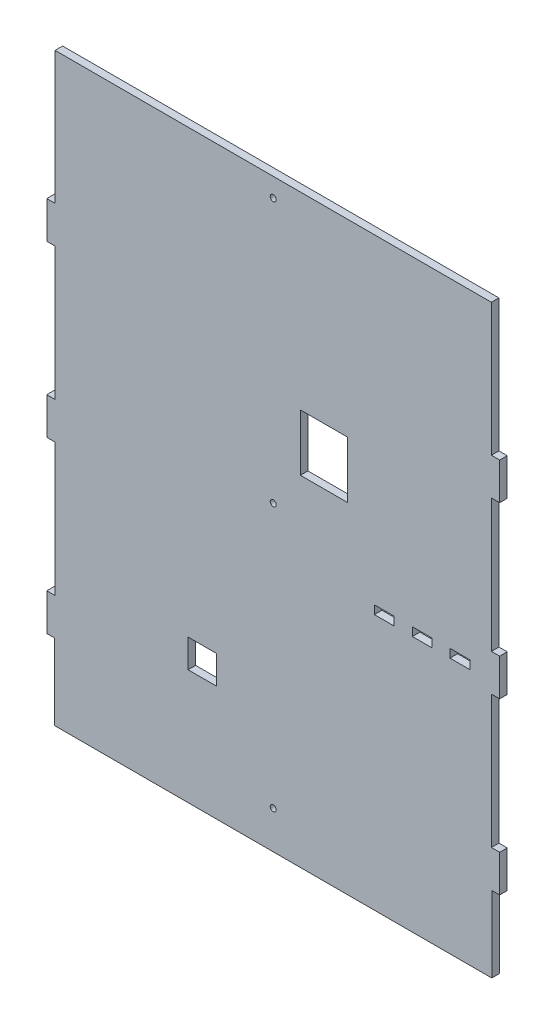
from build123d import *

# Parameters (mm, degrees)
SKETCH1_W           = 240
SKETCH1_H           = 330
BOSS_EXTRUDE1_DEPTH = 4
SKETCH2_W           = 4.399999998
SKETCH2_H           = 70.4
SKETCH2_W_2         = 4.2
SKETCH2_H_2         = 40.2
CUT_EXTRUDE1_DEPTH  = 223.60545834
SKETCH3_W           = 15
SKETCH3_H           = 15
CUT_EXTRUDE2_DEPTH  = 223.60545834
SKETCH4_R           = 1.6
CUT_EXTRUDE3_DEPTH  = 223.60545834
SKETCH7_W           = 240
SKETCH7_H           = 20
CUT_EXTRUDE6_DEPTH  = 223.60545834
SKETCH12_W          = 10.5
SKETCH12_H          = 4.5
CUT_EXTRUDE7_DEPTH  = 207.768445568
BOSS_EXTRUDE3_DEPTH = 3
SKETCH16_W          = 25
SKETCH16_H          = 30
CUT_EXTRUDE8_DEPTH  = 207.848229729


with BuildPart() as part:
    # Sketch1 → Boss-Extrude1 (new body)
    with BuildSketch(Plane.XY):
        with Locations((-10.909090909, 15)):
            Rectangle(SKETCH1_W, SKETCH1_H)
    extrude(amount=BOSS_EXTRUDE1_DEPTH)

    # Sketch2 → Cut-Extrude1 (cut, through all)
    with BuildSketch(Plane(origin=(0, 0, 0), x_dir=(-1, 0, 0), z_dir=(0, 0, -1))):
        with Locations((128.70909091, 125)):
            Rectangle(SKETCH2_W, SKETCH2_H)
        with Locations((128.70909091, 35)):
            Rectangle(SKETCH2_W, SKETCH2_H)
        with Locations((128.70909091, -55)):
            Rectangle(SKETCH2_W, SKETCH2_H)
        with Locations((128.809090909, -129.9)):
            Rectangle(SKETCH2_W_2, SKETCH2_H_2)
        with Locations((-106.990909091, -129.9)):
            Rectangle(SKETCH2_W_2, SKETCH2_H_2)
        with Locations((-106.890909092, -55)):
            Rectangle(SKETCH2_W, SKETCH2_H)
        with Locations((-106.890909092, 35)):
            Rectangle(SKETCH2_W, SKETCH2_H)
        with Locations((-106.890909092, 125)):
            Rectangle(SKETCH2_W, SKETCH2_H)
    extrude(amount=-CUT_EXTRUDE1_DEPTH, mode=Mode.SUBTRACT)

    # Sketch3 → Cut-Extrude2 (cut, through all)
    with BuildSketch(Plane(origin=(0, 0, 0), x_dir=(-1, 0, 0), z_dir=(0, 0, -1))):
        with Locations((48.509090911, -81.5)):
            Rectangle(SKETCH3_W, SKETCH3_H)
    extrude(amount=-CUT_EXTRUDE2_DEPTH, mode=Mode.SUBTRACT)

    # Sketch4 → Cut-Extrude3 (cut, through all)
    with BuildSketch(Plane.XY.offset(4)):
        with Locations((-10.909090909, 150)):
            Circle(SKETCH4_R)
        with Locations((-10.909090909, 10)):
            Circle(SKETCH4_R)
        with Locations((-10.909090909, -130)):
            Circle(SKETCH4_R)
    extrude(amount=-CUT_EXTRUDE3_DEPTH, mode=Mode.SUBTRACT)

    # Sketch7 → Cut-Extrude6 (cut, through all)
    with BuildSketch(Plane.XY.offset(4)):
        with Locations((-10.909090909, 170)):
            Rectangle(SKETCH7_W, SKETCH7_H)
    extrude(amount=-CUT_EXTRUDE6_DEPTH, mode=Mode.SUBTRACT)

    # Sketch12 → Cut-Extrude7 (cut, through all)
    with BuildSketch(Plane(origin=(0, 0, 0), x_dir=(-1, 0, 0), z_dir=(0, 0, -1))):
        with Locations((-47.948836745, -12.082796699)):
            Rectangle(SKETCH12_W, SKETCH12_H)
        with Locations((-68.047560544, -12.082796699)):
            Rectangle(SKETCH12_W, SKETCH12_H)
        with Locations((-87.980631171, -12.03069998)):
            Rectangle(SKETCH12_W, SKETCH12_H)
    extrude(amount=-CUT_EXTRUDE7_DEPTH, mode=Mode.SUBTRACT)

    # Sketch15 → Boss-Extrude3 (add)
    # profile 1 of 15: a face of its own
    with BuildSketch(Plane(origin=(0, 0, 0), x_dir=(-1, 0, 0), z_dir=(0, 0, -1))):
        with BuildLine():
            Line((2.720419797, 122.306979783), (4.563652668, 122.306979783))
            Line((4.563652668, 122.306979783), (5.051429306, 122.306979783))
            add(Edge.make_bspline(
                [(5.051429306, 122.306979783), (5.254969969, 122.301983491), (5.635688659, 122.292638028), (6.168803744, 122.214470002), (6.624106601, 122.083562887), (6.999357674, 121.891139228), (7.294406628, 121.641079841), (7.50228153, 121.329445273), (7.627534758, 120.9621469), (7.642156146, 120.699271211), (7.649777934, 120.562240271)],
                knots=[0, 0, 0, 0, 1.376915923, 2.575493358, 3.636544274, 4.568880867, 5.408940472, 6.224729631, 7.074593134, 8, 8, 8, 8], degree=3))
            add(Edge.make_bspline(
                [(7.649777934, 120.562240271), (7.638529772, 120.403923094), (7.615886738, 120.085223798), (7.410850177, 119.63091524), (7.089668706, 119.211786498), (6.659868121, 118.829516703), (6.14102038, 118.501827834), (5.541279297, 118.273287129), (4.883209254, 118.128603007), (4.422187308, 118.11278), (4.18374971, 118.104596442)],
                knots=[0, 0, 0, 0, 0.808533692, 1.627613149, 2.509578825, 3.503050807, 4.562016858, 5.638503591, 6.778649184, 8, 8, 8, 8], degree=3))
            Line((4.18374971, 118.104596442), (3.691282912, 118.104596442))
            Line((3.691282912, 118.104596442), (0.741172286, 118.104596442))
            Line((0.741172286, 118.104596442), (-2.865560737, 110.745735437))
            add(Edge.make_bspline(
                [(-2.865560737, 110.745735437), (-3.030649935, 110.423182139), (-3.355197453, 109.789077223), (-3.897897711, 108.88939918), (-4.464437242, 108.046230014), (-5.064243948, 107.266025478), (-5.699473891, 106.550192801), (-6.36672396, 105.89808053), (-7.06069043, 105.302570051), (-7.793050992, 104.777103558), (-8.552012437, 104.304940726), (-9.346510404, 103.901330097), (-10.174170534, 103.563102912), (-11.030519308, 103.279705522), (-11.92106478, 103.067837154), (-12.839438054, 102.902885022), (-13.792001987, 102.817409342), (-14.437606584, 102.80313953), (-14.764496601, 102.795914274)],
                knots=[0, 0, 0, 0, 1.145626893, 2.252178628, 3.320434453, 4.356842005, 5.361985326, 6.344449254, 7.305467248, 8.250957564, 9.19223707, 10.129782385, 11.065396228, 12.017585107, 12.979327788, 13.958002351, 14.966072037, 16, 16, 16, 16], degree=3))
            add(Edge.make_bspline(
                [(-14.764496601, 102.795914274), (-15.094663322, 102.801529206), (-15.742608096, 102.812548385), (-16.692618837, 102.919532965), (-17.600729676, 103.086859782), (-18.467885134, 103.320416874), (-19.290404044, 103.625524984), (-20.069273026, 103.999827442), (-20.808950498, 104.434199669), (-21.494048332, 104.940723521), (-22.119348509, 105.492921134), (-22.669015708, 106.086527522), (-23.133069429, 106.71849645), (-23.509838088, 107.390334252), (-23.809515366, 108.095443005), (-24.0132417, 108.84032999), (-24.145342376, 109.616955191), (-24.160550413, 110.147972544), (-24.168267357, 110.417424238)],
                knots=[0, 0, 0, 0, 1.172678423, 2.301355072, 3.391895178, 4.451016386, 5.487969234, 6.504123209, 7.517723418, 8.530943053, 9.526406008, 10.477730013, 11.399870783, 12.305195449, 13.208899822, 14.114582267, 15.043291145, 16, 16, 16, 16], degree=3))
            add(Edge.make_bspline(
                [(-24.168267357, 110.417424238), (-24.164192438, 110.628721079), (-24.156046844, 111.051094666), (-24.076637724, 111.679591065), (-23.956319689, 112.302732466), (-23.780639776, 112.916581679), (-23.561024695, 113.524477505), (-23.28637857, 114.120275179), (-22.96622245, 114.710092251), (-22.595608503, 115.288254778), (-22.183447809, 115.85623982), (-21.728650222, 116.404135239), (-21.233587641, 116.930153823), (-20.70430145, 117.437552349), (-20.133998629, 117.920678989), (-19.527292886, 118.386322983), (-18.881723537, 118.832622515), (-18.427477889, 119.106009892), (-18.197693705, 119.244305317)],
                knots=[0, 0, 0, 0, 0.908591912, 1.8162374, 2.721087669, 3.63662307, 4.560029957, 5.499054133, 6.456114258, 7.444975018, 8.451248392, 9.4734219, 10.505964575, 11.557262555, 12.625992857, 13.719658534, 14.846469079, 16, 16, 16, 16], degree=3))
            add(Edge.make_bspline(
                [(-18.197693705, 119.244305317), (-17.788240394, 119.468229463), (-16.952248106, 119.925421661), (-15.608915317, 120.499020364), (-14.175341002, 121.013422847), (-12.660265697, 121.440756641), (-11.105753905, 121.79049574), (-9.544677939, 122.045046902), (-7.993589993, 122.201712135), (-6.961988752, 122.218764677), (-6.44884296, 122.227247063)],
                knots=[0, 0, 0, 0, 0.914008118, 1.86615596, 2.858389127, 3.896923398, 4.948590696, 5.979028215, 6.994715085, 8, 8, 8, 8], degree=3))
            Line((-6.44884296, 122.227247063), (-3.784832093, 122.288219143))
            Line((-3.784832093, 122.288219143), (-3.137590016, 122.297599463))
            Line((-3.137590016, 122.297599463), (0.412861088, 129.689291588))
            Line((0.412861088, 129.689291588), (0.614537967, 130.120786306))
            add(Edge.make_bspline(
                [(0.614537967, 130.120786306), (0.69537846, 130.287916102), (0.847972765, 130.603389872), (1.144807865, 131.00901491), (1.469521398, 131.333952955), (1.852865258, 131.571996967), (2.312226758, 131.730954153), (2.8645397, 131.837916478), (3.525723723, 131.900279), (4.002251941, 131.908176029), (4.25879227, 131.912427418)],
                knots=[0, 0, 0, 0, 1.015393662, 1.916654457, 2.740540512, 3.517816665, 4.366059275, 5.389192467, 6.594464303, 8, 8, 8, 8], degree=3))
            Line((4.25879227, 131.912427418), (13.958043105, 131.912427418))
            add(Edge.make_bspline(
                [(13.958043105, 131.912427418), (14.216309231, 131.907964168), (14.700023244, 131.899604819), (15.372321253, 131.815505203), (15.946323548, 131.686429902), (16.41703871, 131.490663596), (16.793964423, 131.241825953), (17.064289951, 130.926230358), (17.229198642, 130.547993707), (17.246355275, 130.275658889), (17.255225569, 130.134856786)],
                knots=[0, 0, 0, 0, 1.480288381, 2.772474435, 3.879307617, 4.843465724, 5.681537971, 6.444924413, 7.195997363, 8, 8, 8, 8], degree=3))
            add(Edge.make_bspline(
                [(17.255225569, 130.134856786), (17.242169555, 129.981177534), (17.21551946, 129.66748557), (17.001555264, 129.217340153), (16.653738507, 128.805143964), (16.192911605, 128.429737659), (15.640806684, 128.107402108), (15.011478243, 127.879360088), (14.324227145, 127.734065843), (13.844687974, 127.718227867), (13.596900786, 127.710044077)],
                knots=[0, 0, 0, 0, 0.764441547, 1.560387414, 2.43628462, 3.438973809, 4.511922902, 5.61017539, 6.765131283, 8, 8, 8, 8], degree=3))
            Line((13.596900786, 127.710044077), (13.090363509, 127.710044077))
            Line((13.090363509, 127.710044077), (5.468853544, 127.710044077))
            Line((5.468853544, 127.710044077), (2.720419797, 122.306979783))
        make_face()
        with BuildLine():
            Line((-5.079316247, 118.104596442), (-5.820361523, 118.104596442))
            add(Edge.make_bspline(
                [(-5.820361523, 118.104596442), (-6.264552719, 118.098605596), (-7.132185143, 118.086903762), (-8.400640307, 117.98666582), (-9.602185981, 117.824790117), (-10.739294116, 117.596823648), (-11.808705932, 117.294938146), (-12.816670458, 116.937509608), (-13.75626943, 116.505340044), (-14.340284096, 116.162974172), (-14.628481962, 115.994024452)],
                knots=[0, 0, 0, 0, 1.161737349, 2.269205244, 3.325826024, 4.331531473, 5.299946976, 6.230000582, 7.126545812, 8, 8, 8, 8], degree=3))
            add(Edge.make_bspline(
                [(-14.628481962, 115.994024452), (-14.908940565, 115.81004301), (-15.448664764, 115.455982784), (-16.167968921, 114.861538423), (-16.78326342, 114.250093212), (-17.282789597, 113.609482443), (-17.680782982, 112.94879239), (-17.960591354, 112.260917226), (-18.131827672, 111.548283212), (-18.153816972, 111.064027963), (-18.164862585, 110.820777996)],
                knots=[0, 0, 0, 0, 1.227832178, 2.362882556, 3.411675513, 4.399122573, 5.33116255, 6.227637118, 7.109710811, 8, 8, 8, 8], degree=3))
            add(Edge.make_bspline(
                [(-18.164862585, 110.820777996), (-18.160533485, 110.692469618), (-18.152057687, 110.441258998), (-18.106949787, 110.072898843), (-18.02158366, 109.724134989), (-17.902843011, 109.395249432), (-17.75880183, 109.081224526), (-17.573266396, 108.790188704), (-17.35658021, 108.516380144), (-17.026979415, 108.182977169), (-16.565585016, 107.826359874), (-15.941203674, 107.522054201), (-15.266536087, 107.331439918), (-14.797029905, 107.309587228), (-14.558129562, 107.298467853)],
                knots=[0, 0, 0, 0, 0.819882975, 1.605221063, 2.36578533, 3.10810003, 3.836307703, 4.567794991, 5.30708051, 6.062711335, 7.558784039, 9.005856245, 10.476480192, 12, 12, 12, 12], degree=3))
            add(Edge.make_bspline(
                [(-14.558129562, 107.298467853), (-14.3936973, 107.30105282), (-14.068150117, 107.306170606), (-13.585713169, 107.378405901), (-13.112329439, 107.477668915), (-12.651994215, 107.625819996), (-12.200258862, 107.809190555), (-11.76249774, 108.039949992), (-11.3324979, 108.308983512), (-10.914639074, 108.618698769), (-10.510486157, 108.973543766), (-10.115771803, 109.36847768), (-9.732969471, 109.805919991), (-9.355632703, 110.279474395), (-8.995316893, 110.798285925), (-8.643989772, 111.357379364), (-8.299931259, 111.956828276), (-8.089837173, 112.378352326), (-7.982525273, 112.593658468)],
                knots=[0, 0, 0, 0, 0.883486399, 1.749148882, 2.618275251, 3.482507392, 4.34596207, 5.237255805, 6.140094817, 7.071721226, 8.031161252, 9.029987502, 10.072484893, 11.155819927, 12.284787538, 13.467487725, 14.706442858, 16, 16, 16, 16], degree=3))
            Line((-7.982525273, 112.593658468), (-5.079316247, 118.104596442))
        make_face(mode=Mode.SUBTRACT)
    # profile 2 of 15: a face of its own
    with BuildSketch(Plane(origin=(0, 0, 0), x_dir=(-1, 0, 0), z_dir=(0, 0, -1))):
        with BuildLine():
            Line((16.401616453, 118.404766681), (15.824726776, 117.279128286))
            add(Edge.make_bspline(
                [(15.824726776, 117.279128286), (15.742330031, 117.129913872), (15.583216887, 116.841771734), (15.292819327, 116.458638813), (14.979220626, 116.132258808), (14.635867495, 115.863752138), (14.262972723, 115.654751141), (13.859878354, 115.511108734), (13.43087533, 115.416367843), (13.134666672, 115.407579365), (12.982489829, 115.403064295)],
                knots=[0, 0, 0, 0, 1.13479789, 2.191363975, 3.19350475, 4.143933423, 5.086158949, 6.028902861, 6.987351211, 8, 8, 8, 8], degree=3))
            add(Edge.make_bspline(
                [(12.982489829, 115.403064295), (12.825622056, 115.409204745), (12.521425644, 115.421112245), (12.08331342, 115.518209144), (11.68115205, 115.671504658), (11.32461224, 115.886551131), (11.025977266, 116.150351549), (10.809197604, 116.462192584), (10.673558841, 116.812112857), (10.658951458, 117.059034009), (10.65148032, 117.185325086)],
                knots=[0, 0, 0, 0, 1.152522701, 2.234960474, 3.283278552, 4.304645039, 5.281424467, 6.190349519, 7.074430413, 8, 8, 8, 8], degree=3))
            add(Edge.make_bspline(
                [(10.65148032, 117.185325086), (10.658164217, 117.268666467), (10.673299864, 117.457392538), (10.769527493, 117.76555686), (10.909399146, 118.135436916), (11.033905802, 118.397831564), (11.101735678, 118.54078132)],
                knots=[0, 0, 0, 0, 0.696273728, 1.576707802, 2.679816705, 4, 4, 4, 4], degree=3))
            Line((11.101735678, 118.54078132), (13.263899428, 122.94484154))
            add(Edge.make_bspline(
                [(13.263899428, 122.94484154), (13.337695886, 123.08403859), (13.480398562, 123.353208575), (13.732479479, 123.716395823), (14.013382807, 124.020618856), (14.314057198, 124.27366231), (14.643002333, 124.467305456), (14.992426049, 124.611999298), (15.369378597, 124.691469204), (15.627394317, 124.70264068), (15.759064536, 124.708341691)],
                knots=[0, 0, 0, 0, 1.167716458, 2.258052313, 3.267212292, 4.230582512, 5.161093992, 6.086826532, 7.023672013, 8, 8, 8, 8], degree=3))
            add(Edge.make_bspline(
                [(15.759064536, 124.708341691), (15.910928138, 124.705377774), (16.201941865, 124.699698067), (16.614835001, 124.639733767), (16.97999336, 124.538226094), (17.29545174, 124.394742886), (17.570845804, 124.218722138), (17.78762294, 123.986783312), (17.962408002, 123.72059364), (18.034567187, 123.520462256), (18.071313405, 123.418547697)],
                knots=[0, 0, 0, 0, 1.274761978, 2.442805444, 3.494329087, 4.446283387, 5.345809342, 6.218779819, 7.09293452, 8, 8, 8, 8], degree=3))
            Line((18.071313405, 123.418547697), (18.226088685, 122.94484154))
            add(Edge.make_bspline(
                [(18.226088685, 122.94484154), (18.241779705, 122.899682252), (18.26944493, 122.820060799), (18.303759792, 122.717250999), (18.333081674, 122.656072662), (18.359026389, 122.602746063), (18.452583847, 122.619370521), (18.591399719, 122.608248598), (18.834219042, 122.606678816), (19.022421136, 122.606977337), (19.13128956, 122.607150021)],
                knots=[0, 0, 0, 0, 1.019710328, 1.797876388, 2.273823764, 2.513532399, 2.946949923, 3.977439729, 5.673087535, 8, 8, 8, 8], degree=3))
            Line((19.13128956, 122.607150021), (23.55411042, 122.607150021))
            add(Edge.make_bspline(
                [(23.55411042, 122.607150021), (23.788952874, 122.602640818), (24.229103013, 122.594189509), (24.844162988, 122.509973054), (25.370974289, 122.377446267), (25.801968721, 122.174046752), (26.147180686, 121.918543036), (26.388041812, 121.59338995), (26.537963897, 121.210671854), (26.552765186, 120.935770385), (26.560502966, 120.79205811)],
                knots=[0, 0, 0, 0, 1.424264346, 2.669407238, 3.760305722, 4.706634181, 5.545407217, 6.338565211, 7.131439438, 8, 8, 8, 8], degree=3))
            add(Edge.make_bspline(
                [(26.560502966, 120.79205811), (26.551923327, 120.604832159), (26.535488476, 120.246188816), (26.373621855, 119.743537372), (26.094849674, 119.321486046), (25.712281846, 118.971708939), (25.214290601, 118.719732265), (24.62102144, 118.531318009), (23.922218949, 118.423214475), (23.421596047, 118.411169973), (23.155446822, 118.404766681)],
                knots=[0, 0, 0, 0, 0.949413145, 1.818661906, 2.644955175, 3.49411381, 4.421738653, 5.45682936, 6.647958583, 8, 8, 8, 8], degree=3))
            Line((23.155446822, 118.404766681), (23.028812502, 118.315653641))
            add(Edge.make_bspline(
                [(23.028812502, 118.315653641), (22.809998408, 118.151864105), (22.395653661, 117.841713455), (21.831510679, 117.372876567), (21.354552302, 116.931977813), (20.963260793, 116.519587983), (20.650106926, 116.136708553), (20.434620174, 115.774303912), (20.284720119, 115.440880281), (20.265753889, 115.219830179), (20.256927955, 115.116964536)],
                knots=[0, 0, 0, 0, 1.511348652, 2.861878599, 4.054791021, 5.100656894, 6.005340111, 6.780823198, 7.432656193, 8, 8, 8, 8], degree=3))
            add(Edge.make_bspline(
                [(20.256927955, 115.116964536), (20.259733884, 115.044484989), (20.265019461, 114.907953989), (20.325806874, 114.718973228), (20.412496253, 114.553917557), (20.547920486, 114.424185432), (20.714109503, 114.318336475), (20.920492133, 114.251682345), (21.15875112, 114.208742503), (21.329180189, 114.204595413), (21.42008763, 114.20238334)],
                knots=[0, 0, 0, 0, 1.026442445, 1.933527729, 2.799360047, 3.648188179, 4.56718082, 5.579565065, 6.708931834, 8, 8, 8, 8], degree=3))
            Line((21.42008763, 114.20238334), (23.802688899, 114.20238334))
            add(Edge.make_bspline(
                [(23.802688899, 114.20238334), (24.04203631, 114.197040571), (24.489425077, 114.187053852), (25.115861408, 114.113555829), (25.644440579, 113.971543427), (26.089009581, 113.79177814), (26.43340509, 113.537239065), (26.684250371, 113.227154444), (26.838465688, 112.855287747), (26.853085441, 112.587333699), (26.860673204, 112.448263509)],
                knots=[0, 0, 0, 0, 1.452114611, 2.714296192, 3.813909604, 4.7653051, 5.605559132, 6.381655992, 7.160067146, 8, 8, 8, 8], degree=3))
            add(Edge.make_bspline(
                [(26.860673204, 112.448263509), (26.859028805, 112.358811711), (26.855796757, 112.182995282), (26.798476639, 111.927282651), (26.722654899, 111.682634278), (26.605771074, 111.453424296), (26.460140969, 111.238298784), (26.283409403, 111.032523643), (26.073482874, 110.842594824), (25.743921261, 110.60520499), (25.261197302, 110.354835246), (24.593312177, 110.146525011), (23.830853672, 110.020674177), (23.290419688, 110.007139184), (23.005361702, 110)],
                knots=[0, 0, 0, 0, 0.631460621, 1.241128239, 1.846363317, 2.440063218, 3.053732636, 3.681304915, 4.354782956, 5.051836253, 6.551222385, 8.178077176, 9.984083801, 12, 12, 12, 12], degree=3))
            Line((23.005361702, 110), (19.30013532, 110))
            add(Edge.make_bspline(
                [(19.30013532, 110), (19.140535593, 110.003860537), (18.828304169, 110.011413062), (18.371462294, 110.062919558), (17.937715426, 110.151062631), (17.52738889, 110.280019981), (17.135257531, 110.438809062), (16.765800033, 110.635139588), (16.419047665, 110.868425448), (16.097913139, 111.133247495), (15.806729178, 111.428486906), (15.552163906, 111.749257719), (15.334663015, 112.091260917), (15.163365912, 112.457115228), (15.015340549, 112.838715326), (14.92926416, 113.249077474), (14.862236266, 113.676465239), (14.856685795, 113.96914669), (14.85386366, 114.117960461)],
                knots=[0, 0, 0, 0, 1.125675863, 2.202205387, 3.238150751, 4.24268838, 5.231793657, 6.218436938, 7.187984774, 8.17493614, 9.149675283, 10.107233456, 11.058740144, 12.000806348, 12.953334926, 13.937757146, 14.951453418, 16, 16, 16, 16], degree=3))
            add(Edge.make_bspline(
                [(14.85386366, 114.117960461), (14.862704846, 114.310807473), (14.880333284, 114.695325105), (15.001188103, 115.266308213), (15.206015967, 115.8220963), (15.490980444, 116.369830427), (15.872677642, 116.9045229), (16.356317581, 117.427167705), (16.947305855, 117.932667148), (17.389972649, 118.242844672), (17.621058047, 118.404766681)],
                knots=[0, 0, 0, 0, 0.868495292, 1.731692648, 2.616115617, 3.5295564, 4.504551852, 5.566136935, 6.729450178, 8, 8, 8, 8], degree=3))
            Line((17.621058047, 118.404766681), (16.401616453, 118.404766681))
        make_face()
    # profile 3 of 15: a face of its own
    with BuildSketch(Plane(origin=(0, 0, 0), x_dir=(-1, 0, 0), z_dir=(0, 0, -1))):
        with BuildLine():
            add(Edge.make_bspline(
                [(32.873458296, 114.502553579), (32.878804729, 114.477535719), (32.891122056, 114.419898559), (32.981508498, 114.362706628), (33.101524086, 114.310505419), (33.272538598, 114.272281066), (33.489947329, 114.239999838), (33.754905081, 114.218538498), (34.067716093, 114.204441817), (34.29142488, 114.203103602), (34.411830769, 114.20238334)],
                knots=[0, 0, 0, 0, 0.363824208, 0.838192937, 1.466672271, 2.320535985, 3.391193422, 4.707814869, 6.228060317, 8, 8, 8, 8], degree=3))
            Line((34.411830769, 114.20238334), (40.025952263, 114.20238334))
            add(Edge.make_bspline(
                [(40.025952263, 114.20238334), (40.263879945, 114.197819537), (40.710178978, 114.189258865), (41.331585098, 114.105973388), (41.861682287, 113.973456634), (42.302879098, 113.786211234), (42.648313997, 113.529364754), (42.891623329, 113.212039349), (43.048735603, 112.840103107), (43.062620866, 112.570289509), (43.069866089, 112.429502869)],
                knots=[0, 0, 0, 0, 1.442503263, 2.705812981, 3.793730749, 4.748857816, 5.59473986, 6.372384658, 7.150722956, 8, 8, 8, 8], degree=3))
            add(Edge.make_bspline(
                [(43.069866089, 112.429502869), (43.068022537, 112.341657697), (43.064367364, 112.167488841), (43.009461226, 111.915736283), (42.929593483, 111.675594717), (42.8152651, 111.448594299), (42.669057404, 111.233861094), (42.494118941, 111.027720603), (42.280969002, 110.84292865), (41.953658608, 110.604603946), (41.470185066, 110.355061683), (40.80256839, 110.146455101), (40.040027794, 110.02069489), (39.499606093, 110.007146337), (39.214554587, 110)],
                knots=[0, 0, 0, 0, 0.622458954, 1.234136855, 1.82030829, 2.415965822, 3.031658718, 3.661300318, 4.329574064, 5.028925784, 6.533255903, 8.16547499, 9.977436636, 12, 12, 12, 12], degree=3))
            Line((39.214554587, 110), (33.863082052, 110))
            add(Edge.make_bspline(
                [(33.863082052, 110), (33.612784028, 110.002855223), (33.127025568, 110.008396411), (32.420902912, 110.072501886), (31.758664472, 110.166687179), (31.141654905, 110.309576831), (30.567000195, 110.484114285), (30.03927988, 110.707439741), (29.552325547, 110.963006551), (29.11499838, 111.26578573), (28.72215182, 111.601596144), (28.386721623, 111.982970671), (28.098312146, 112.397321957), (27.861033775, 112.850424606), (27.686332425, 113.342763085), (27.550857426, 113.867841775), (27.479121373, 114.431799274), (27.467147345, 114.81974632), (27.461013681, 115.018471177)],
                knots=[0, 0, 0, 0, 1.298566351, 2.520154101, 3.6767768, 4.767160584, 5.803912827, 6.789394743, 7.736765843, 8.652729849, 9.544219053, 10.412060686, 11.280812085, 12.159021663, 13.057388523, 13.986198775, 14.968435609, 16, 16, 16, 16], degree=3))
            add(Edge.make_bspline(
                [(27.461013681, 115.018471177), (27.469741365, 115.273717749), (27.486968432, 115.777534086), (27.605701796, 116.521116035), (27.809033249, 117.234353807), (28.087506729, 117.923282531), (28.451541147, 118.581575046), (28.896184523, 119.211122955), (29.415036583, 119.816912447), (30.012460394, 120.379377241), (30.657141083, 120.902819915), (31.344889242, 121.360080749), (32.063513118, 121.744201586), (32.809900499, 122.062074445), (33.587533294, 122.307040818), (34.396705164, 122.4771551), (35.234038111, 122.591573355), (35.802858258, 122.601913689), (36.090908041, 122.607150021)],
                knots=[0, 0, 0, 0, 0.961222697, 1.897301478, 2.827416789, 3.74916356, 4.689952735, 5.653732886, 6.647480042, 7.68865919, 8.73973096, 9.771829957, 10.793937507, 11.804446491, 12.823088337, 13.859009688, 14.915805288, 16, 16, 16, 16], degree=3))
            add(Edge.make_bspline(
                [(36.090908041, 122.607150021), (36.313060634, 122.603895475), (36.747163295, 122.597535851), (37.381082396, 122.537842598), (37.9841111, 122.453626573), (38.552003654, 122.319257612), (39.089359433, 122.157092923), (39.592415046, 121.956222134), (40.060939792, 121.714198785), (40.494180021, 121.439637005), (40.887229896, 121.138582031), (41.227416492, 120.810759267), (41.521793047, 120.470174517), (41.758246503, 120.104827837), (41.942909702, 119.722033922), (42.077173998, 119.319076189), (42.150842506, 118.895228956), (42.163144828, 118.606703868), (42.169355373, 118.4610486)],
                knots=[0, 0, 0, 0, 1.30268841, 2.545549882, 3.732199611, 4.871117868, 5.964683962, 7.022166325, 8.043401657, 9.053376064, 10.027364427, 10.941861589, 11.820146992, 12.662061504, 13.486464177, 14.30713523, 15.145396082, 16, 16, 16, 16], degree=3))
            add(Edge.make_bspline(
                [(42.169355373, 118.4610486), (42.162427916, 118.283793051), (42.148854289, 117.936479348), (42.033115512, 117.43020629), (41.837643125, 116.958786718), (41.5727425, 116.514418919), (41.224175215, 116.110901938), (40.804747992, 115.736359618), (40.3102247, 115.392634525), (39.940839385, 115.201854802), (39.749232824, 115.102894056)],
                knots=[0, 0, 0, 0, 0.968872173, 1.898403658, 2.822766327, 3.751234837, 4.716021478, 5.727446331, 6.821187053, 8, 8, 8, 8], degree=3))
            add(Edge.make_bspline(
                [(39.749232824, 115.102894056), (39.64374974, 115.053955545), (39.422923351, 114.951503906), (39.05903081, 114.832662218), (38.656198944, 114.730350642), (38.214367299, 114.646873398), (37.732238547, 114.581216931), (37.209439091, 114.536019641), (36.646229138, 114.507463996), (36.258226961, 114.504224609), (36.058076921, 114.502553579)],
                knots=[0, 0, 0, 0, 0.739870317, 1.548901348, 2.432574942, 3.385319564, 4.410220056, 5.529583224, 6.725641129, 8, 8, 8, 8], degree=3))
            Line((36.058076921, 114.502553579), (32.873458296, 114.502553579))
        make_face()
        with BuildLine():
            Line((33.783349332, 117.804426204), (35.260749725, 117.804426204))
            add(Edge.make_bspline(
                [(35.260749725, 117.804426204), (35.38274402, 117.804636752), (35.609706244, 117.805028463), (35.924025546, 117.825071087), (36.189522447, 117.850096389), (36.402572161, 117.890998889), (36.570069107, 117.93990217), (36.684167948, 118.00443662), (36.768523836, 118.08263734), (36.767008357, 118.148476958), (36.766291078, 118.179639002)],
                knots=[0, 0, 0, 0, 1.771847728, 3.296404152, 4.575675562, 5.640336041, 6.452028579, 7.083138133, 7.566047158, 8, 8, 8, 8], degree=3))
            add(Edge.make_bspline(
                [(36.766291078, 118.179639002), (36.749529014, 118.26076722), (36.715726465, 118.424371218), (36.496560233, 118.601085957), (36.187582622, 118.692655999), (35.949542359, 118.700485137), (35.814188602, 118.704936919)],
                knots=[0, 0, 0, 0, 0.80637568, 1.626145471, 2.650185792, 4, 4, 4, 4], degree=3))
            add(Edge.make_bspline(
                [(35.814188602, 118.704936919), (35.612712503, 118.695047811), (35.222388728, 118.675889439), (34.670537766, 118.500688557), (34.178174166, 118.213672096), (33.916738926, 117.94268788), (33.783349332, 117.804426204)],
                knots=[0, 0, 0, 0, 1.051792421, 2.037659008, 2.998773583, 4, 4, 4, 4], degree=3))
        make_face(mode=Mode.SUBTRACT)
    # profile 4 of 15: a face of its own
    with BuildSketch(Plane(origin=(0, 0, 0), x_dir=(-1, 0, 0), z_dir=(0, 0, -1))):
        with BuildLine():
            Line((57.234149222, 114.20238334), (58.791282335, 114.20238334))
            add(Edge.make_bspline(
                [(58.791282335, 114.20238334), (59.01669288, 114.197696594), (59.441167358, 114.188870903), (60.031792497, 114.106530029), (60.535068268, 113.972833684), (60.95434336, 113.785770647), (61.277951511, 113.52416956), (61.51952049, 113.214072211), (61.655072998, 112.836699692), (61.671693331, 112.56970515), (61.680420882, 112.429502869)],
                knots=[0, 0, 0, 0, 1.415559398, 2.66566427, 3.735559159, 4.680184967, 5.525369366, 6.324862349, 7.120363587, 8, 8, 8, 8], degree=3))
            add(Edge.make_bspline(
                [(61.680420882, 112.429502869), (61.66969641, 112.257202827), (61.648540268, 111.917306907), (61.447637559, 111.438043014), (61.125282236, 111.013588202), (60.683788288, 110.651065373), (60.139634185, 110.355544185), (59.502353243, 110.148125198), (58.779163797, 110.020409009), (58.268130791, 110.007046511), (57.998645299, 110)],
                knots=[0, 0, 0, 0, 0.838740437, 1.654581445, 2.495060207, 3.42248703, 4.424382746, 5.504429779, 6.683998954, 8, 8, 8, 8], degree=3))
            Line((57.998645299, 110), (55.442508111, 110))
            add(Edge.make_bspline(
                [(55.442508111, 110), (55.311048437, 110.004118087), (55.059759658, 110.011989925), (54.699137974, 110.057146296), (54.37291054, 110.139178129), (54.084973483, 110.264665821), (53.825718879, 110.412382454), (53.608270694, 110.603682182), (53.425545007, 110.827457018), (53.335444933, 110.997261575), (53.289724681, 111.083426955)],
                knots=[0, 0, 0, 0, 1.234870282, 2.360488483, 3.407606644, 4.381313989, 5.303032531, 6.198166557, 7.085680223, 8, 8, 8, 8], degree=3))
            add(Edge.make_bspline(
                [(53.289724681, 111.083426955), (53.211753429, 110.997274025), (53.057837058, 110.827206904), (52.795512847, 110.601960781), (52.50576562, 110.416214713), (52.189831919, 110.264801658), (51.854282947, 110.142609717), (51.490875413, 110.056698121), (51.103623157, 110.013031175), (50.836864235, 110.00440256), (50.700756373, 110)],
                knots=[0, 0, 0, 0, 0.959799645, 1.894658299, 2.848086846, 3.795894543, 4.785080407, 5.794319374, 6.874600065, 8, 8, 8, 8], degree=3))
            Line((50.700756373, 110), (48.299394464, 110))
            add(Edge.make_bspline(
                [(48.299394464, 110), (48.117847404, 110.002981281), (47.76304854, 110.008807622), (47.245562944, 110.072389761), (46.755885243, 110.169709714), (46.291954004, 110.305751354), (45.856402392, 110.483007665), (45.449188418, 110.702164415), (45.066599271, 110.954950193), (44.716042406, 111.2496398), (44.403296561, 111.57930381), (44.123435949, 111.929468803), (43.891628305, 112.311938613), (43.699248788, 112.716837129), (43.554563596, 113.150672094), (43.444604005, 113.605178795), (43.385308599, 114.088273944), (43.375211499, 114.417985797), (43.370036327, 114.586976459)],
                knots=[0, 0, 0, 0, 1.148128276, 2.243796228, 3.293304121, 4.30425161, 5.298018475, 6.2627585, 7.225721978, 8.194611441, 9.153093626, 10.097020169, 11.025003951, 11.976364728, 12.927314017, 13.913420631, 14.930543671, 16, 16, 16, 16], degree=3))
            add(Edge.make_bspline(
                [(43.370036327, 114.586976459), (43.378874392, 114.842217539), (43.396426282, 115.34911164), (43.515312639, 116.100262059), (43.719225708, 116.83092915), (44.002009413, 117.541625866), (44.364611945, 118.231832993), (44.818062508, 118.893206948), (45.337399423, 119.544977553), (45.939151727, 120.158128911), (46.584246756, 120.72895256), (47.263100161, 121.228467355), (47.960297681, 121.654709748), (48.677959886, 122.002386052), (49.417839358, 122.273962583), (50.177385301, 122.463340593), (50.957766209, 122.587633315), (51.485100063, 122.600602067), (51.751352208, 122.607150021)],
                knots=[0, 0, 0, 0, 0.959012508, 1.904543668, 2.84949067, 3.804012475, 4.77367156, 5.772451162, 6.812846292, 7.901306525, 8.996073793, 10.046487951, 11.064060174, 12.062476907, 13.038167592, 14.01985282, 15.000218873, 16, 16, 16, 16], degree=3))
            add(Edge.make_bspline(
                [(51.751352208, 122.607150021), (51.957816873, 122.603345665), (52.355791115, 122.596012518), (52.92979503, 122.545923712), (53.456589605, 122.456964116), (53.935659775, 122.336657231), (54.367270501, 122.184434512), (54.74727356, 121.988439096), (55.084489746, 121.762677483), (55.271567073, 121.576816892), (55.362775391, 121.486201786)],
                knots=[0, 0, 0, 0, 1.275253826, 2.458135748, 3.555125067, 4.571592047, 5.506337131, 6.374409531, 7.207454081, 8, 8, 8, 8], degree=3))
            Line((55.362775391, 121.486201786), (59.401003132, 129.623629348))
            add(Edge.make_bspline(
                [(59.401003132, 129.623629348), (59.500811321, 129.803838482), (59.693984596, 130.152623375), (60.02895821, 130.625866703), (60.406086823, 131.018381079), (60.803876757, 131.348240511), (61.23954188, 131.59901364), (61.70053395, 131.78656444), (62.198133275, 131.889381967), (62.538283423, 131.904629129), (62.712256077, 131.912427418)],
                knots=[0, 0, 0, 0, 1.16136951, 2.247766987, 3.25801502, 4.223249411, 5.151705617, 6.081625772, 7.018831366, 8, 8, 8, 8], degree=3))
            add(Edge.make_bspline(
                [(62.712256077, 131.912427418), (62.886380752, 131.907021426), (63.223866858, 131.896543606), (63.706344992, 131.790254051), (64.148660974, 131.621066233), (64.533309959, 131.382107906), (64.863297255, 131.115547432), (65.098819101, 130.813157109), (65.254725661, 130.495795615), (65.273338883, 130.272476634), (65.282463745, 130.162997746)],
                knots=[0, 0, 0, 0, 1.22521914, 2.374703268, 3.463016305, 4.545571475, 5.554073659, 6.433295846, 7.231946039, 8, 8, 8, 8], degree=3))
            add(Edge.make_bspline(
                [(65.282463745, 130.162997746), (65.277090355, 130.078221139), (65.265612272, 129.897130044), (65.19235242, 129.609731732), (65.0817073, 129.288623141), (64.976872868, 129.069205304), (64.921321426, 128.952936471)],
                knots=[0, 0, 0, 0, 0.799736507, 1.708315122, 2.785643278, 4, 4, 4, 4], degree=3))
            Line((64.921321426, 128.952936471), (64.766546147, 128.807541512))
            Line((64.766546147, 128.807541512), (57.234149222, 114.20238334))
        make_face()
        with BuildLine():
            Line((49.715822778, 114.20238334), (50.433417254, 114.20238334))
            add(Edge.make_bspline(
                [(50.433417254, 114.20238334), (50.606320498, 114.209509633), (50.925984511, 114.222684743), (51.357101703, 114.339989749), (51.702746862, 114.545960713), (51.839089887, 114.752676741), (51.906127487, 114.854315577)],
                knots=[0, 0, 0, 0, 1.224042084, 2.263012509, 3.145952109, 4, 4, 4, 4], degree=3))
            Line((51.906127487, 114.854315577), (53.341316441, 117.602749324))
            add(Edge.make_bspline(
                [(53.341316441, 117.602749324), (53.376348581, 117.671232214), (53.44008758, 117.79583296), (53.518197922, 117.969507723), (53.563345561, 118.113343446), (53.572145189, 118.199780398), (53.575824439, 118.235920922)],
                knots=[0, 0, 0, 0, 1.357252559, 2.469444308, 3.360052828, 4, 4, 4, 4], degree=3))
            add(Edge.make_bspline(
                [(53.575824439, 118.235920922), (53.571276085, 118.283760633), (53.561977344, 118.381565042), (53.48079401, 118.520480689), (53.35755939, 118.649195666), (53.191504928, 118.769286114), (52.992141067, 118.879165435), (52.752580618, 118.950797679), (52.485006122, 118.999392417), (52.2956611, 119.003148405), (52.196917406, 119.005107158)],
                knots=[0, 0, 0, 0, 0.664431927, 1.358377181, 2.193126463, 3.145638966, 4.210972387, 5.357855698, 6.622118035, 8, 8, 8, 8], degree=3))
            add(Edge.make_bspline(
                [(52.196917406, 119.005107158), (52.004019733, 118.991824246), (51.607413592, 118.964513994), (51.027527233, 118.719055662), (50.450036685, 118.351624184), (49.99144785, 117.940022134), (49.645791475, 117.559834817), (49.412286213, 117.256292763), (49.214508809, 116.942896282), (49.05508766, 116.616572891), (48.926330833, 116.283019116), (48.83715079, 115.93844622), (48.78488811, 115.584460362), (48.777052017, 115.34539054), (48.773100622, 115.224838216)],
                knots=[0, 0, 0, 0, 1.243918401, 2.557551202, 4.017512603, 5.666395966, 6.526166329, 7.341866334, 8.142102631, 8.920542043, 9.689250994, 10.45261234, 11.219720924, 12, 12, 12, 12], degree=3))
            add(Edge.make_bspline(
                [(48.773100622, 115.224838216), (48.774692987, 115.144707154), (48.777691761, 114.99380278), (48.828918338, 114.784858239), (48.893467152, 114.601878172), (49.003036775, 114.454859041), (49.140368202, 114.341494326), (49.307451374, 114.260140129), (49.501502236, 114.206718973), (49.641953697, 114.203877687), (49.715822778, 114.20238334)],
                knots=[0, 0, 0, 0, 1.203959603, 2.267320162, 3.230084133, 4.106801695, 4.993909881, 5.889739845, 6.890129183, 8, 8, 8, 8], degree=3))
        make_face(mode=Mode.SUBTRACT)
    # profile 5 of 15: a face of its own
    with BuildSketch(Plane(origin=(0, 0, 0), x_dir=(-1, 0, 0), z_dir=(0, 0, -1))):
        with BuildLine():
            Line((-38.102732652, 80.483827333), (-36.259499781, 80.483827333))
            Line((-36.259499781, 80.483827333), (-35.771723143, 80.483827333))
            add(Edge.make_bspline(
                [(-35.771723143, 80.483827333), (-35.56818248, 80.478831041), (-35.187463791, 80.469485579), (-34.654348706, 80.391317552), (-34.199045848, 80.260410437), (-33.823794776, 80.067986778), (-33.528745821, 79.817927392), (-33.320870919, 79.506292824), (-33.195617692, 79.138994451), (-33.180996303, 78.876118762), (-33.173374515, 78.739087821)],
                knots=[0, 0, 0, 0, 1.376915923, 2.575493358, 3.636544274, 4.568880867, 5.408940472, 6.224729631, 7.074593134, 8, 8, 8, 8], degree=3))
            add(Edge.make_bspline(
                [(-33.173374515, 78.739087821), (-33.184622677, 78.580770645), (-33.207265711, 78.262071348), (-33.412302272, 77.807762791), (-33.733483744, 77.388634049), (-34.163284329, 77.006364254), (-34.682132069, 76.678675385), (-35.281873152, 76.450134679), (-35.939943195, 76.305450557), (-36.400965142, 76.289627551), (-36.639402739, 76.281443993)],
                knots=[0, 0, 0, 0, 0.808533692, 1.627613149, 2.509578825, 3.503050807, 4.562016858, 5.638503591, 6.778649184, 8, 8, 8, 8], degree=3))
            Line((-36.639402739, 76.281443993), (-37.131869537, 76.281443993))
            Line((-37.131869537, 76.281443993), (-40.081980163, 76.281443993))
            Line((-40.081980163, 76.281443993), (-43.688713186, 68.922582987))
            add(Edge.make_bspline(
                [(-43.688713186, 68.922582987), (-43.853802385, 68.600029689), (-44.178349903, 67.965924774), (-44.72105016, 67.06624673), (-45.287589691, 66.223077565), (-45.887396397, 65.442873028), (-46.52262634, 64.727040352), (-47.189876409, 64.07492808), (-47.883842879, 63.479417601), (-48.616203442, 62.953951109), (-49.375164886, 62.481788277), (-50.169662853, 62.078177648), (-50.997322984, 61.739950463), (-51.853671758, 61.456553073), (-52.744217229, 61.244684705), (-53.662590503, 61.079732572), (-54.615154436, 60.994256893), (-55.260759034, 60.979987081), (-55.587649051, 60.972761824)],
                knots=[0, 0, 0, 0, 1.145626893, 2.252178628, 3.320434453, 4.356842005, 5.361985326, 6.344449254, 7.305467248, 8.250957564, 9.19223707, 10.129782385, 11.065396228, 12.017585107, 12.979327788, 13.958002351, 14.966072037, 16, 16, 16, 16], degree=3))
            add(Edge.make_bspline(
                [(-55.587649051, 60.972761824), (-55.917815771, 60.978376757), (-56.565760546, 60.989395935), (-57.515771286, 61.096380516), (-58.423882126, 61.263707332), (-59.291037583, 61.497264425), (-60.113556493, 61.802372535), (-60.892425476, 62.176674993), (-61.632102947, 62.611047219), (-62.317200782, 63.117571071), (-62.942500958, 63.669768685), (-63.492168157, 64.263375073), (-63.956221879, 64.895344001), (-64.332990537, 65.567181803), (-64.632667816, 66.272290556), (-64.83639415, 67.01717754), (-64.968494825, 67.793802742), (-64.983702862, 68.324820094), (-64.991419807, 68.594271789)],
                knots=[0, 0, 0, 0, 1.172678423, 2.301355072, 3.391895178, 4.451016386, 5.487969234, 6.504123209, 7.517723418, 8.530943053, 9.526406008, 10.477730013, 11.399870783, 12.305195449, 13.208899822, 14.114582267, 15.043291145, 16, 16, 16, 16], degree=3))
            add(Edge.make_bspline(
                [(-64.991419807, 68.594271789), (-64.987344888, 68.80556863), (-64.979199294, 69.227942217), (-64.899790174, 69.856438615), (-64.779472138, 70.479580016), (-64.603792225, 71.093429229), (-64.384177144, 71.701325056), (-64.10953102, 72.29712273), (-63.789374899, 72.886939802), (-63.418760952, 73.465102328), (-63.006600259, 74.033087371), (-62.551802671, 74.58098279), (-62.05674009, 75.107001374), (-61.527453899, 75.6143999), (-60.957151078, 76.09752654), (-60.350445336, 76.563170534), (-59.704875986, 77.009470066), (-59.250630338, 77.282857442), (-59.020846155, 77.421152867)],
                knots=[0, 0, 0, 0, 0.908591912, 1.8162374, 2.721087669, 3.63662307, 4.560029957, 5.499054133, 6.456114258, 7.444975018, 8.451248392, 9.4734219, 10.505964575, 11.557262555, 12.625992857, 13.719658534, 14.846469079, 16, 16, 16, 16], degree=3))
            add(Edge.make_bspline(
                [(-59.020846155, 77.421152867), (-58.611392843, 77.645077014), (-57.775400555, 78.102269212), (-56.432067766, 78.675867914), (-54.998493451, 79.190270398), (-53.483418146, 79.617604191), (-51.928906355, 79.967343291), (-50.367830388, 80.221894453), (-48.816742442, 80.378559686), (-47.785141201, 80.395612228), (-47.271995409, 80.404094614)],
                knots=[0, 0, 0, 0, 0.914008118, 1.86615596, 2.858389127, 3.896923398, 4.948590696, 5.979028215, 6.994715085, 8, 8, 8, 8], degree=3))
            Line((-47.271995409, 80.404094614), (-44.607984542, 80.465066693))
            Line((-44.607984542, 80.465066693), (-43.960742465, 80.474447013))
            Line((-43.960742465, 80.474447013), (-40.410291362, 87.866139139))
            Line((-40.410291362, 87.866139139), (-40.208614482, 88.297633857))
            add(Edge.make_bspline(
                [(-40.208614482, 88.297633857), (-40.12777399, 88.464763652), (-39.975179684, 88.780237423), (-39.678344585, 89.18586246), (-39.353631052, 89.510800505), (-38.970287191, 89.748844518), (-38.510925691, 89.907801704), (-37.958612749, 90.014764028), (-37.297428727, 90.077126551), (-36.820900508, 90.08502358), (-36.564360179, 90.089274968)],
                knots=[0, 0, 0, 0, 1.015393662, 1.916654457, 2.740540512, 3.517816665, 4.366059275, 5.389192467, 6.594464303, 8, 8, 8, 8], degree=3))
            Line((-36.564360179, 90.089274968), (-26.865109345, 90.089274968))
            add(Edge.make_bspline(
                [(-26.865109345, 90.089274968), (-26.606843218, 90.084811718), (-26.123129206, 90.07645237), (-25.450831196, 89.992352753), (-24.876828901, 89.863277453), (-24.406113739, 89.667511146), (-24.029188026, 89.418673504), (-23.758862498, 89.103077909), (-23.593953807, 88.724841258), (-23.576797174, 88.452506439), (-23.56792688, 88.311704337)],
                knots=[0, 0, 0, 0, 1.480288381, 2.772474435, 3.879307617, 4.843465724, 5.681537971, 6.444924413, 7.195997363, 8, 8, 8, 8], degree=3))
            add(Edge.make_bspline(
                [(-23.56792688, 88.311704337), (-23.580982894, 88.158025085), (-23.607632989, 87.84433312), (-23.821597186, 87.394187704), (-24.169413942, 86.981991514), (-24.630240845, 86.60658521), (-25.182345765, 86.284249658), (-25.811674207, 86.056207638), (-26.498925305, 85.910913394), (-26.978464475, 85.895075417), (-27.226251663, 85.886891628)],
                knots=[0, 0, 0, 0, 0.764441547, 1.560387414, 2.43628462, 3.438973809, 4.511922902, 5.61017539, 6.765131283, 8, 8, 8, 8], degree=3))
            Line((-27.226251663, 85.886891628), (-27.732788941, 85.886891628))
            Line((-27.732788941, 85.886891628), (-35.354298905, 85.886891628))
            Line((-35.354298905, 85.886891628), (-38.102732652, 80.483827333))
        make_face()
        with BuildLine():
            Line((-45.902468696, 76.281443993), (-46.643513972, 76.281443993))
            add(Edge.make_bspline(
                [(-46.643513972, 76.281443993), (-47.087705169, 76.275453147), (-47.955337592, 76.263751312), (-49.223792757, 76.16351337), (-50.42533843, 76.001637668), (-51.562446566, 75.773671199), (-52.631858382, 75.471785697), (-53.639822908, 75.114357159), (-54.57942188, 74.682187595), (-55.163436545, 74.339821722), (-55.451634411, 74.170872003)],
                knots=[0, 0, 0, 0, 1.161737349, 2.269205244, 3.325826024, 4.331531473, 5.299946976, 6.230000582, 7.126545812, 8, 8, 8, 8], degree=3))
            add(Edge.make_bspline(
                [(-55.451634411, 74.170872003), (-55.732093014, 73.986890561), (-56.271817214, 73.632830334), (-56.991121371, 73.038385974), (-57.606415869, 72.426940763), (-58.105942046, 71.786329993), (-58.503935431, 71.125639941), (-58.783743804, 70.437764776), (-58.954980122, 69.725130763), (-58.976969421, 69.240875514), (-58.988015035, 68.997625547)],
                knots=[0, 0, 0, 0, 1.227832178, 2.362882556, 3.411675513, 4.399122573, 5.33116255, 6.227637118, 7.109710811, 8, 8, 8, 8], degree=3))
            add(Edge.make_bspline(
                [(-58.988015035, 68.997625547), (-58.983685935, 68.869317169), (-58.975210136, 68.618106549), (-58.930102236, 68.249746393), (-58.844736109, 67.900982539), (-58.725995461, 67.572096982), (-58.58195428, 67.258072076), (-58.396418845, 66.967036254), (-58.179732659, 66.693227695), (-57.850131864, 66.35982472), (-57.388737465, 66.003207424), (-56.764356123, 65.698901752), (-56.089688536, 65.508287469), (-55.620182354, 65.486434778), (-55.381282012, 65.475315403)],
                knots=[0, 0, 0, 0, 0.819882975, 1.605221063, 2.36578533, 3.10810003, 3.836307703, 4.567794991, 5.30708051, 6.062711335, 7.558784039, 9.005856245, 10.476480192, 12, 12, 12, 12], degree=3))
            add(Edge.make_bspline(
                [(-55.381282012, 65.475315403), (-55.216849749, 65.477900371), (-54.891302567, 65.483018156), (-54.408865618, 65.555253452), (-53.935481888, 65.654516465), (-53.475146664, 65.802667547), (-53.023411311, 65.986038105), (-52.585650189, 66.216797542), (-52.155650349, 66.485831063), (-51.737791523, 66.79554632), (-51.333638607, 67.150391317), (-50.938924253, 67.545325231), (-50.55612192, 67.982767542), (-50.178785153, 68.456321945), (-49.818469342, 68.975133475), (-49.467142221, 69.534226915), (-49.123083708, 70.133675826), (-48.912989623, 70.555199877), (-48.805677722, 70.770506019)],
                knots=[0, 0, 0, 0, 0.883486399, 1.749148882, 2.618275251, 3.482507392, 4.34596207, 5.237255805, 6.140094817, 7.071721226, 8.031161252, 9.029987502, 10.072484893, 11.155819927, 12.284787538, 13.467487725, 14.706442858, 16, 16, 16, 16], degree=3))
            Line((-48.805677722, 70.770506019), (-45.902468696, 76.281443993))
        make_face(mode=Mode.SUBTRACT)
    # profile 6 of 15: a face of its own
    with BuildSketch(Plane(origin=(0, 0, 0), x_dir=(-1, 0, 0), z_dir=(0, 0, -1))):
        with BuildLine():
            Line((-23.929069199, 72.379230891), (-22.540781845, 72.379230891))
            add(Edge.make_bspline(
                [(-22.540781845, 72.379230891), (-22.315305481, 72.374866271), (-21.893804014, 72.366707128), (-21.305523193, 72.281188309), (-20.803827294, 72.151987327), (-20.386614699, 71.960861508), (-20.062942003, 71.702670112), (-19.827314765, 71.389228493), (-19.690774035, 71.01377107), (-19.674342297, 70.746629767), (-19.665713778, 70.606350419)],
                knots=[0, 0, 0, 0, 1.419947262, 2.654423925, 3.737135029, 4.675786199, 5.523590448, 6.31966986, 7.117636944, 8, 8, 8, 8], degree=3))
            add(Edge.make_bspline(
                [(-19.665713778, 70.606350419), (-19.676685851, 70.434177919), (-19.698200462, 70.096573132), (-19.89371041, 69.617173518), (-20.216160176, 69.198542118), (-20.647722256, 68.830446956), (-21.188878624, 68.538776022), (-21.8233519, 68.321185277), (-22.551731589, 68.19850083), (-23.067180837, 68.184307689), (-23.338109041, 68.176847551)],
                knots=[0, 0, 0, 0, 0.839829461, 1.646781256, 2.488351297, 3.40531131, 4.401804911, 5.478480844, 6.674650008, 8, 8, 8, 8], degree=3))
            Line((-23.338109041, 68.176847551), (-26.738475025, 68.176847551))
            add(Edge.make_bspline(
                [(-26.738475025, 68.176847551), (-26.984480807, 68.182726207), (-27.453036203, 68.193923002), (-28.118776411, 68.313871616), (-28.711307658, 68.503700501), (-29.226856556, 68.767255187), (-29.646802053, 69.104534657), (-29.956898642, 69.509226348), (-30.137273171, 69.982683077), (-30.159994635, 70.317183109), (-30.171672129, 70.48909642)],
                knots=[0, 0, 0, 0, 1.275142768, 2.428703178, 3.495776905, 4.493512673, 5.415790461, 6.267487969, 7.109590877, 8, 8, 8, 8], degree=3))
            add(Edge.make_bspline(
                [(-30.171672129, 70.48909642), (-30.1622744, 70.595945577), (-30.140790407, 70.840211649), (-30.021975444, 71.239143035), (-29.836811441, 71.712573408), (-29.676959189, 72.047266747), (-29.590092292, 72.229145772)],
                knots=[0, 0, 0, 0, 0.695726815, 1.590489448, 2.690623987, 4, 4, 4, 4], degree=3))
            Line((-29.590092292, 72.229145772), (-21.879469288, 87.748885139))
            Line((-21.879469288, 87.748885139), (-21.668412089, 88.170999537))
            add(Edge.make_bspline(
                [(-21.668412089, 88.170999537), (-21.586495706, 88.323617771), (-21.427429091, 88.619974432), (-21.127815272, 89.011029191), (-20.795895152, 89.347003408), (-20.425418744, 89.619032805), (-20.016864573, 89.830567143), (-19.573576314, 89.977595614), (-19.094778628, 90.07723585), (-18.762609188, 90.085184441), (-18.591667143, 90.089274968)],
                knots=[0, 0, 0, 0, 1.080752844, 2.098624116, 3.06563414, 4.022975061, 4.957927201, 5.927892943, 6.933645986, 8, 8, 8, 8], degree=3))
            add(Edge.make_bspline(
                [(-18.591667143, 90.089274968), (-18.419020195, 90.084313322), (-18.084121828, 90.074688783), (-17.606464889, 89.962089245), (-17.170094347, 89.789073606), (-16.791065584, 89.54548712), (-16.475602077, 89.267471578), (-16.241345108, 88.966801905), (-16.093179101, 88.649464262), (-16.073349318, 88.428790026), (-16.063670915, 88.321084657)],
                knots=[0, 0, 0, 0, 1.223818514, 2.373947672, 3.464660471, 4.542754249, 5.557039064, 6.436434883, 7.236864429, 8, 8, 8, 8], degree=3))
            add(Edge.make_bspline(
                [(-16.063670915, 88.321084657), (-16.069164041, 88.237891139), (-16.081014615, 88.058413944), (-16.152268849, 87.777213856), (-16.261550364, 87.463121922), (-16.361676899, 87.249281174), (-16.415432914, 87.134474182)],
                knots=[0, 0, 0, 0, 0.801240667, 1.728553272, 2.78050387, 4, 4, 4, 4], degree=3))
            Line((-16.415432914, 87.134474182), (-16.621799953, 86.721740104))
            Line((-16.621799953, 86.721740104), (-23.929069199, 72.379230891))
        make_face()
    # profile 7 of 15: a face of its own
    with BuildSketch(Plane(origin=(0, 0, 0), x_dir=(-1, 0, 0), z_dir=(0, 0, -1))):
        with BuildLine():
            Line((-12.93064405, 72.379230891), (-11.396961737, 72.379230891))
            add(Edge.make_bspline(
                [(-11.396961737, 72.379230891), (-11.174627476, 72.37474343), (-10.757830157, 72.366331044), (-10.177073699, 72.282021456), (-9.681907666, 72.15114515), (-9.270850585, 71.960796793), (-8.950714463, 71.70274051), (-8.723033901, 71.386705865), (-8.576980954, 71.015344463), (-8.565452725, 70.746929579), (-8.55941495, 70.606350419)],
                knots=[0, 0, 0, 0, 1.412328628, 2.647611671, 3.720497418, 4.658278404, 5.505675581, 6.302753184, 7.111086809, 8, 8, 8, 8], degree=3))
            add(Edge.make_bspline(
                [(-8.55941495, 70.606350419), (-8.570213311, 70.43404707), (-8.591387298, 70.096185709), (-8.788686835, 69.620423522), (-9.099272657, 69.195284451), (-9.532095436, 68.832528329), (-10.069080825, 68.537198541), (-10.700334077, 68.322874798), (-11.424871207, 68.197556218), (-11.93736513, 68.184010301), (-12.208359413, 68.176847551)],
                knots=[0, 0, 0, 0, 0.843080425, 1.653155914, 2.488857706, 3.409367253, 4.40300313, 5.483846854, 6.669519604, 8, 8, 8, 8], degree=3))
            Line((-12.208359413, 68.176847551), (-15.214751959, 68.176847551))
            add(Edge.make_bspline(
                [(-15.214751959, 68.176847551), (-15.490528126, 68.182137494), (-16.016946893, 68.192235267), (-16.761991838, 68.319827085), (-17.429784041, 68.503667715), (-17.916932178, 68.741356398), (-18.258208723, 68.959772701), (-18.469988551, 69.147142564), (-18.656533557, 69.343487208), (-18.806334679, 69.558783223), (-18.921731029, 69.791430166), (-19.007064782, 70.038411365), (-19.052537578, 70.304553804), (-19.061039776, 70.485819362), (-19.065373301, 70.578209459)],
                knots=[0, 0, 0, 0, 1.957978788, 3.737512159, 5.358736599, 6.864797704, 7.570652017, 8.232436366, 8.869400257, 9.492147696, 10.088555572, 10.710608479, 11.342803953, 12, 12, 12, 12], degree=3))
            add(Edge.make_bspline(
                [(-19.065373301, 70.578209459), (-19.058965607, 70.683364072), (-19.045325352, 70.907209932), (-18.959280301, 71.254728381), (-18.825668822, 71.633950428), (-18.706583301, 71.890857244), (-18.643258903, 72.027468893)],
                knots=[0, 0, 0, 0, 0.829935087, 1.766708357, 2.812434573, 4, 4, 4, 4], degree=3))
            Line((-18.643258903, 72.027468893), (-15.547753318, 78.396706143))
            Line((-15.547753318, 78.396706143), (-15.341386279, 78.837581181))
            add(Edge.make_bspline(
                [(-15.341386279, 78.837581181), (-15.260694592, 78.99144128), (-15.103533182, 79.291111186), (-14.811861041, 79.692187627), (-14.480085379, 80.031060512), (-14.109337649, 80.304062697), (-13.708885303, 80.524998751), (-13.267153551, 80.673447078), (-12.792726014, 80.771504296), (-12.462147022, 80.779765255), (-12.292782293, 80.783997572)],
                knots=[0, 0, 0, 0, 1.085331993, 2.113877083, 3.088606736, 4.038859373, 4.983715813, 5.935977869, 6.942544569, 8, 8, 8, 8], degree=3))
            add(Edge.make_bspline(
                [(-12.292782293, 80.783997572), (-12.121764493, 80.778612391), (-11.79042784, 80.768178928), (-11.313895383, 80.660930449), (-10.876604389, 80.489928324), (-10.498195489, 80.243085199), (-10.175820854, 79.971679834), (-9.939087529, 79.673004039), (-9.788213473, 79.355598869), (-9.769403681, 79.134563839), (-9.760095905, 79.02518758)],
                knots=[0, 0, 0, 0, 1.213567542, 2.351213784, 3.452973147, 4.531804395, 5.547755582, 6.434530594, 7.225348188, 8, 8, 8, 8], degree=3))
            add(Edge.make_bspline(
                [(-9.760095905, 79.02518758), (-9.769758217, 78.927725182), (-9.791946757, 78.703912453), (-9.907902697, 78.332217261), (-10.085598824, 77.881368347), (-10.242231747, 77.559220043), (-10.327605262, 77.383631588)],
                knots=[0, 0, 0, 0, 0.671206951, 1.541360188, 2.659906756, 4, 4, 4, 4], degree=3))
            Line((-10.327605262, 77.383631588), (-12.93064405, 72.379230891))
        make_face()
    # profile 8 of 15: a face of its own
    with BuildSketch(Plane(origin=(0, 0, 0), x_dir=(-1, 0, 0), z_dir=(0, 0, -1))):
        with BuildLine():
            add(Edge.make_bspline(
                [(-11.110861978, 85.586721389), (-10.894478114, 85.577635069), (-10.474366845, 85.559993894), (-9.87151689, 85.42613712), (-9.33013476, 85.184442351), (-8.857880129, 84.864108747), (-8.464954548, 84.490793862), (-8.174348714, 84.081413949), (-7.991450633, 83.642256094), (-7.969825224, 83.337075486), (-7.959074473, 83.185359481)],
                knots=[0, 0, 0, 0, 1.188282859, 2.307062129, 3.368290341, 4.425898267, 5.428074752, 6.328651761, 7.169114053, 8, 8, 8, 8], degree=3))
            add(Edge.make_bspline(
                [(-7.959074473, 83.185359481), (-7.969680457, 83.033542331), (-7.991014663, 82.728158268), (-8.176327799, 82.290200884), (-8.457722674, 81.873882693), (-8.854065419, 81.502891376), (-9.32505068, 81.17893339), (-9.870384995, 80.947881978), (-10.472355401, 80.809224053), (-10.892776146, 80.792613831), (-11.110861978, 80.783997572)],
                knots=[0, 0, 0, 0, 0.830175907, 1.669919975, 2.571934103, 3.573254169, 4.629958307, 5.694714699, 6.804173991, 8, 8, 8, 8], degree=3))
            add(Edge.make_bspline(
                [(-11.110861978, 80.783997572), (-11.300879471, 80.791166889), (-11.671694566, 80.805157659), (-12.204871136, 80.942220599), (-12.695797204, 81.159911887), (-13.132999003, 81.457982283), (-13.501902039, 81.817833755), (-13.76403782, 82.236935468), (-13.937057654, 82.695491725), (-13.953878466, 83.019624593), (-13.962479245, 83.185359481)],
                knots=[0, 0, 0, 0, 1.099270284, 2.14520258, 3.167200418, 4.197477239, 5.196857304, 6.129362082, 7.043509633, 8, 8, 8, 8], degree=3))
            add(Edge.make_bspline(
                [(-13.962479245, 83.185359481), (-13.953334476, 83.349330038), (-13.935284277, 83.672979674), (-13.767351414, 84.133415917), (-13.49481963, 84.54741594), (-13.127506748, 84.907880221), (-12.692535433, 85.211537569), (-12.20134011, 85.427304678), (-11.67033482, 85.566185688), (-11.300933543, 85.579744728), (-11.110861978, 85.586721389)],
                knots=[0, 0, 0, 0, 0.948294506, 1.871770016, 2.8023411, 3.802579973, 4.838872445, 5.861748528, 6.899785067, 8, 8, 8, 8], degree=3))
        make_face()
    # profile 9 of 15: a face of its own
    with BuildSketch(Plane(origin=(0, 0, 0), x_dir=(-1, 0, 0), z_dir=(0, 0, -1))):
        with BuildLine():
            Line((6.927493297, 72.379230891), (8.59719025, 72.379230891))
            add(Edge.make_bspline(
                [(8.59719025, 72.379230891), (8.828868383, 72.374717974), (9.262722222, 72.366266824), (9.867100701, 72.282556586), (10.381409851, 72.150232606), (10.810538862, 71.963883384), (11.139819049, 71.701151458), (11.385762555, 71.391440212), (11.527877025, 71.014494724), (11.543699513, 70.746689491), (11.551991036, 70.606350419)],
                knots=[0, 0, 0, 0, 1.432959369, 2.683442387, 3.765268382, 4.713242359, 5.553284818, 6.346629124, 7.133577298, 8, 8, 8, 8], degree=3))
            add(Edge.make_bspline(
                [(11.551991036, 70.606350419), (11.541643876, 70.43391677), (11.521196366, 70.093162522), (11.313845025, 69.614481161), (10.987099599, 69.190399922), (10.540205933, 68.826460637), (9.987226092, 68.532713114), (9.338074582, 68.323644432), (8.600476576, 68.197885492), (8.078679868, 68.184093299), (7.804553213, 68.176847551)],
                knots=[0, 0, 0, 0, 0.82897024, 1.638167098, 2.473408289, 3.395830661, 4.399327879, 5.481122148, 6.67670388, 8, 8, 8, 8], degree=3))
            Line((7.804553213, 68.176847551), (3.850748352, 68.176847551))
            add(Edge.make_bspline(
                [(3.850748352, 68.176847551), (3.643796526, 68.184993183), (3.240198547, 68.200878815), (2.658161727, 68.323301564), (2.12379323, 68.532324822), (1.648995235, 68.81890864), (1.249882984, 69.173246055), (0.955886354, 69.587240291), (0.775303767, 70.056209262), (0.755834995, 70.385886883), (0.745862446, 70.55475866)],
                knots=[0, 0, 0, 0, 1.141244505, 2.225657947, 3.263621067, 4.293235437, 5.270348496, 6.186874124, 7.071256986, 8, 8, 8, 8], degree=3))
            add(Edge.make_bspline(
                [(0.745862446, 70.55475866), (0.754232664, 70.669646569), (0.772920265, 70.926148773), (0.907296926, 71.335078917), (1.09027252, 71.814675788), (1.262609782, 72.144833604), (1.355583243, 72.322948971)],
                knots=[0, 0, 0, 0, 0.73095034, 1.631941732, 2.722466806, 4, 4, 4, 4], degree=3))
            Line((1.355583243, 72.322948971), (3.170675155, 75.812427995))
            add(Edge.make_bspline(
                [(3.170675155, 75.812427995), (3.211207576, 75.888355437), (3.286768557, 76.029900206), (3.369995958, 76.234460852), (3.426244797, 76.4101706), (3.440845231, 76.518810715), (3.447394594, 76.567543751)],
                knots=[0, 0, 0, 0, 1.275205679, 2.377252373, 3.272079025, 4, 4, 4, 4], degree=3))
            add(Edge.make_bspline(
                [(3.447394594, 76.567543751), (3.446862493, 76.604025716), (3.445773416, 76.678695163), (3.391345573, 76.788661503), (3.299264, 76.890763579), (3.171151726, 76.987305268), (3.015581211, 77.07701742), (2.826940927, 77.136401435), (2.614063098, 77.174113961), (2.46264658, 77.179245997), (2.382728279, 77.181954709)],
                knots=[0, 0, 0, 0, 0.642685448, 1.315416207, 2.124629887, 3.076829044, 4.161074603, 5.305475565, 6.577818204, 8, 8, 8, 8], degree=3))
            add(Edge.make_bspline(
                [(2.382728279, 77.181954709), (2.258582325, 77.173980867), (2.010734238, 77.15806169), (1.645811676, 77.051532797), (1.300823173, 76.866022063), (0.962544617, 76.618644606), (0.64000217, 76.295654753), (0.332153981, 75.903201086), (0.033510277, 75.443378436), (-0.14202732, 75.104354632), (-0.234380989, 74.925987759)],
                knots=[0, 0, 0, 0, 0.818784517, 1.63464189, 2.483270392, 3.390751907, 4.389702972, 5.483172805, 6.675849332, 8, 8, 8, 8], degree=3))
            Line((-0.234380989, 74.925987759), (-2.471587299, 70.39998338))
            add(Edge.make_bspline(
                [(-2.471587299, 70.39998338), (-2.565795182, 70.223849995), (-2.748136517, 69.882940133), (-3.086189052, 69.425782509), (-3.465482838, 69.038561252), (-3.891615418, 68.722870409), (-4.359553818, 68.476297413), (-4.871534846, 68.305639789), (-5.422894746, 68.191056862), (-5.805674467, 68.181685402), (-6.003277762, 68.176847551)],
                knots=[0, 0, 0, 0, 1.082159634, 2.094542679, 3.071805929, 4.011262949, 4.959403314, 5.927353451, 6.930032691, 8, 8, 8, 8], degree=3))
            add(Edge.make_bspline(
                [(-6.003277762, 68.176847551), (-6.150742588, 68.181542473), (-6.439153877, 68.190724789), (-6.854799471, 68.283310258), (-7.242248565, 68.429002891), (-7.588942088, 68.633722901), (-7.889316726, 68.879476234), (-8.099009775, 69.179608969), (-8.237652191, 69.509939721), (-8.251940087, 69.745087079), (-8.259244712, 69.865305143)],
                knots=[0, 0, 0, 0, 1.130408589, 2.210849926, 3.251707596, 4.295260092, 5.291070484, 6.203477469, 7.081535671, 8, 8, 8, 8], degree=3))
            add(Edge.make_bspline(
                [(-8.259244712, 69.865305143), (-8.256144724, 69.953303505), (-8.249642771, 70.137872391), (-8.173996153, 70.418708271), (-8.080217307, 70.723402259), (-7.982387492, 70.923318225), (-7.930933513, 71.028464817)],
                knots=[0, 0, 0, 0, 0.864250433, 1.812689869, 2.849575584, 4, 4, 4, 4], degree=3))
            Line((-7.930933513, 71.028464817), (-7.724566474, 71.445889055))
            Line((-7.724566474, 71.445889055), (-3.948987692, 79.11430062))
            add(Edge.make_bspline(
                [(-3.948987692, 79.11430062), (-3.878965485, 79.246170691), (-3.741845202, 79.504403931), (-3.482585822, 79.847325496), (-3.188124165, 80.139564549), (-2.856271995, 80.375458579), (-2.489778494, 80.561071338), (-2.08833137, 80.692647374), (-1.65040111, 80.766803336), (-1.347792534, 80.778133501), (-1.191173625, 80.783997572)],
                knots=[0, 0, 0, 0, 1.046514913, 2.049327302, 3.003609717, 3.947427846, 4.894429182, 5.87631639, 6.900860586, 8, 8, 8, 8], degree=3))
            add(Edge.make_bspline(
                [(-1.191173625, 80.783997572), (-1.042418692, 80.782669369), (-0.759524225, 80.780143461), (-0.356851956, 80.724125604), (0.006922787, 80.650093248), (0.326592168, 80.53216324), (0.605106509, 80.384936296), (0.84485533, 80.207746688), (1.035036467, 79.986841399), (1.129891447, 79.82105294), (1.177357164, 79.738091897)],
                knots=[0, 0, 0, 0, 1.30505148, 2.481879668, 3.56459169, 4.559369037, 5.462354287, 6.324649655, 7.161649646, 8, 8, 8, 8], degree=3))
            add(Edge.make_bspline(
                [(1.177357164, 79.738091897), (1.454346601, 79.900498625), (2.000723367, 80.220854751), (2.89085032, 80.537959118), (3.804947768, 80.747928419), (4.428017393, 80.771914811), (4.741878748, 80.783997572)],
                knots=[0, 0, 0, 0, 1.021832771, 2.015620853, 3.000400753, 4, 4, 4, 4], degree=3))
            add(Edge.make_bspline(
                [(4.741878748, 80.783997572), (4.90922647, 80.781257249), (5.236658814, 80.775895536), (5.716685656, 80.735111892), (6.171653306, 80.657289467), (6.607333989, 80.561797727), (7.019075362, 80.428963241), (7.411527362, 80.271259982), (7.776288531, 80.076521861), (8.119463856, 79.862160403), (8.429467116, 79.627390103), (8.700960062, 79.375632836), (8.931396221, 79.113775688), (9.12253586, 78.839517503), (9.269070883, 78.552035175), (9.372032979, 78.25191348), (9.442635664, 77.941912836), (9.448069461, 77.729529661), (9.450799366, 77.622829747)],
                knots=[0, 0, 0, 0, 1.281744885, 2.507860438, 3.685054636, 4.815017436, 5.920802653, 6.99481731, 8.049976326, 9.083164758, 10.091419566, 11.02341078, 11.914424612, 12.758076087, 13.577413693, 14.376462912, 15.184345617, 16, 16, 16, 16], degree=3))
            add(Edge.make_bspline(
                [(9.450799366, 77.622829747), (9.44300263, 77.502052769), (9.426521311, 77.246745419), (9.332646565, 76.84672437), (9.167930201, 76.416307013), (9.027763197, 76.12254541), (8.953642408, 75.967203274)],
                knots=[0, 0, 0, 0, 0.832279976, 1.759335252, 2.815128856, 4, 4, 4, 4], degree=3))
            Line((8.953642408, 75.967203274), (6.927493297, 72.379230891))
        make_face()
    # profile 10 of 15: a face of its own
    with BuildSketch(Plane(origin=(0, 0, 0), x_dir=(-1, 0, 0), z_dir=(0, 0, -1))):
        with BuildLine():
            Line((22.484753945, 80.783997572), (22.470683465, 80.783997572))
            add(Edge.make_bspline(
                [(22.470683465, 80.783997572), (22.696117354, 80.781029977), (23.120473292, 80.775443788), (23.709897247, 80.695469483), (24.214268657, 80.574117749), (24.627983723, 80.393673844), (24.955675924, 80.159183192), (25.199323973, 79.871181427), (25.332751696, 79.517047293), (25.350599299, 79.266975508), (25.359822011, 79.137751419)],
                knots=[0, 0, 0, 0, 1.449349618, 2.728250482, 3.818791159, 4.777818454, 5.612764932, 6.391986275, 7.169062163, 8, 8, 8, 8], degree=3))
            add(Edge.make_bspline(
                [(25.359822011, 79.137751419), (25.349154522, 78.976211409), (25.328079486, 78.657067736), (25.124422747, 78.20943534), (24.802444985, 77.814623429), (24.359726184, 77.480905991), (23.815554756, 77.210678651), (23.178991222, 77.015831615), (22.454620708, 76.899305389), (21.942724527, 76.88782542), (21.673356269, 76.88178447)],
                knots=[0, 0, 0, 0, 0.804530105, 1.589455711, 2.413049502, 3.333290064, 4.341041178, 5.439785487, 6.65277267, 8, 8, 8, 8], degree=3))
            Line((21.673356269, 76.88178447), (20.749394753, 76.88178447))
            Line((20.749394753, 76.88178447), (18.362103324, 72.379230891))
            Line((18.362103324, 72.379230891), (19.877024997, 72.379230891))
            add(Edge.make_bspline(
                [(19.877024997, 72.379230891), (20.118094777, 72.374783778), (20.569099971, 72.366463902), (21.1980418, 72.282018988), (21.734698841, 72.151111905), (22.181873605, 71.963043374), (22.531447793, 71.706251359), (22.780701975, 71.390403492), (22.937090974, 71.016780378), (22.951133054, 70.747078674), (22.958460102, 70.606350419)],
                knots=[0, 0, 0, 0, 1.448999785, 2.710860015, 3.807710146, 4.763293089, 5.609469157, 6.386255123, 7.157960457, 8, 8, 8, 8], degree=3))
            add(Edge.make_bspline(
                [(22.958460102, 70.606350419), (22.956793064, 70.518469238), (22.953516976, 70.345763934), (22.896530988, 70.09453032), (22.818943389, 69.853901355), (22.705566017, 69.624722706), (22.55102259, 69.414870822), (22.373673884, 69.21038218), (22.158422579, 69.023228561), (21.829475467, 68.780933966), (21.339541297, 68.532334232), (20.669168848, 68.323843087), (19.906723586, 68.197711264), (19.367872666, 68.184039923), (19.084387961, 68.176847551)],
                knots=[0, 0, 0, 0, 0.620960276, 1.220319652, 1.815573779, 2.409797162, 3.021206694, 3.656609837, 4.323274598, 5.036411429, 6.546932126, 8.185766389, 9.993365421, 12, 12, 12, 12], degree=3))
            Line((19.084387961, 68.176847551), (15.698092456, 68.176847551))
            add(Edge.make_bspline(
                [(15.698092456, 68.176847551), (15.44592227, 68.183060901), (14.9635754, 68.194945694), (14.277821472, 68.311286568), (13.667934356, 68.509533129), (13.216086275, 68.736875541), (12.901932325, 68.956654434), (12.706246762, 69.142178653), (12.532536022, 69.335583838), (12.391990258, 69.547059799), (12.2810896, 69.775445547), (12.209432953, 70.019911899), (12.158172738, 70.277479817), (12.154314547, 70.454429631), (12.152331513, 70.54537834)],
                knots=[0, 0, 0, 0, 1.902288005, 3.638664344, 5.22841603, 6.727315395, 7.437921295, 8.114288584, 8.758167681, 9.396398606, 10.024512205, 10.666550251, 11.314633174, 12, 12, 12, 12], degree=3))
            add(Edge.make_bspline(
                [(12.152331513, 70.54537834), (12.156731485, 70.658368429), (12.165866276, 70.892947393), (12.24833037, 71.247232501), (12.362946665, 71.618648645), (12.477425879, 71.859880848), (12.536924631, 71.985257453)],
                knots=[0, 0, 0, 0, 0.901076215, 1.870726241, 2.893343794, 4, 4, 4, 4], degree=3))
            Line((12.536924631, 71.985257453), (12.912137429, 72.68409129))
            Line((12.912137429, 72.68409129), (15.210315819, 76.88178447))
            Line((15.210315819, 76.88178447), (15.229076459, 76.88178447))
            add(Edge.make_bspline(
                [(15.229076459, 76.88178447), (15.034855601, 76.884613688), (14.671076675, 76.88991286), (14.164093526, 76.97130604), (13.732767067, 77.093549314), (13.372611205, 77.266159123), (13.092403109, 77.49971271), (12.892443864, 77.787996841), (12.769843057, 78.127854504), (12.758566188, 78.372183635), (12.75267199, 78.499889662)],
                knots=[0, 0, 0, 0, 1.391269149, 2.605870464, 3.670011253, 4.597531547, 5.448740828, 6.254204012, 7.087506802, 8, 8, 8, 8], degree=3))
            add(Edge.make_bspline(
                [(12.75267199, 78.499889662), (12.754858659, 78.589228501), (12.759149218, 78.764524178), (12.807920172, 79.018157709), (12.883558664, 79.255896291), (12.986950277, 79.479661022), (13.124151372, 79.685522979), (13.289687064, 79.876678989), (13.490234346, 80.044379954), (13.797462186, 80.256102537), (14.249451966, 80.470560911), (14.861555874, 80.659920868), (15.557063798, 80.763275001), (16.046407372, 80.776867026), (16.303123094, 80.783997572)],
                knots=[0, 0, 0, 0, 0.679091616, 1.332475619, 1.957061892, 2.574468119, 3.201429468, 3.833786067, 4.491918876, 5.184937265, 6.669447472, 8.276304181, 10.046502892, 12, 12, 12, 12], degree=3))
            Line((16.303123094, 80.783997572), (16.98788645, 80.783997572))
            Line((16.98788645, 80.783997572), (17.883707006, 82.655371403))
            Line((17.883707006, 82.655371403), (18.090074045, 83.082175961))
            add(Edge.make_bspline(
                [(18.090074045, 83.082175961), (18.172615956, 83.232778457), (18.333058601, 83.525515355), (18.623771035, 83.91775735), (18.954548344, 84.246689907), (19.314305587, 84.522683946), (19.716002262, 84.729450997), (20.14772518, 84.882011917), (20.615898583, 84.972204903), (20.939733855, 84.98157465), (21.105846911, 84.986380912)],
                knots=[0, 0, 0, 0, 1.090069046, 2.118845577, 3.087847352, 4.045126177, 4.986774274, 5.944670965, 6.945707847, 8, 8, 8, 8], degree=3))
            add(Edge.make_bspline(
                [(21.105846911, 84.986380912), (21.273768638, 84.981113635), (21.59745173, 84.970960519), (22.061624527, 84.863293457), (22.485146734, 84.692084746), (22.849252334, 84.445213869), (23.160685502, 84.172593178), (23.383604616, 83.867583432), (23.536281522, 83.550492246), (23.55138326, 83.327644008), (23.55880058, 83.2181906)],
                knots=[0, 0, 0, 0, 1.211743691, 2.335736725, 3.424936322, 4.493719938, 5.501688536, 6.398997818, 7.213657032, 8, 8, 8, 8], degree=3))
            add(Edge.make_bspline(
                [(23.55880058, 83.2181906), (23.551090847, 83.108254337), (23.534237533, 82.867935948), (23.429933659, 82.483215583), (23.271178461, 82.043513894), (23.125598052, 81.739547613), (23.047573142, 81.576634608)],
                knots=[0, 0, 0, 0, 0.762193498, 1.66613917, 2.749149816, 4, 4, 4, 4], degree=3))
            Line((23.047573142, 81.576634608), (22.484753945, 80.783997572))
        make_face()
    # profile 11 of 15: a face of its own
    with BuildSketch(Plane(origin=(0, 0, 0), x_dir=(-1, 0, 0), z_dir=(0, 0, -1))):
        with BuildLine():
            Line((30.875450146, 75.990654074), (30.889520625, 75.470046317))
            add(Edge.make_bspline(
                [(30.889520625, 75.470046317), (30.809880851, 75.344195373), (30.653692902, 75.097378992), (30.367839643, 74.77243789), (30.054543937, 74.491175513), (29.700504411, 74.269670411), (29.317249898, 74.094806465), (28.9012979, 73.967853392), (28.451890483, 73.89149686), (28.141394464, 73.883960233), (27.981621439, 73.880082084)],
                knots=[0, 0, 0, 0, 1.02420106, 2.008642853, 2.969790467, 3.913596757, 4.872329423, 5.86334284, 6.900532832, 8, 8, 8, 8], degree=3))
            add(Edge.make_bspline(
                [(27.981621439, 73.880082084), (27.837210991, 73.886361481), (27.55308034, 73.898716329), (27.137759909, 73.998311699), (26.740234885, 74.151371958), (26.378247922, 74.370021858), (26.061368148, 74.62451591), (25.82958879, 74.924173298), (25.68808271, 75.256858485), (25.669403356, 75.489068157), (25.65999225, 75.606060956)],
                knots=[0, 0, 0, 0, 1.08797102, 2.140606306, 3.204802141, 4.288739949, 5.318404912, 6.252333467, 7.119483714, 8, 8, 8, 8], degree=3))
            add(Edge.make_bspline(
                [(25.65999225, 75.606060956), (25.668167314, 75.71787394), (25.685789293, 75.958895403), (25.812550905, 76.332143863), (25.993341262, 76.748292192), (26.164123131, 77.02453827), (26.255642567, 77.172574389)],
                knots=[0, 0, 0, 0, 0.790786242, 1.704600392, 2.769929868, 4, 4, 4, 4], degree=3))
            Line((26.255642567, 77.172574389), (28.783638795, 81.26708405))
            add(Edge.make_bspline(
                [(28.783638795, 81.26708405), (28.868430228, 81.395738793), (29.032607445, 81.644846244), (29.316171141, 81.973710596), (29.614130517, 82.254573833), (29.927069359, 82.486958011), (30.261857927, 82.662926319), (30.612055696, 82.789542311), (30.979294408, 82.874481196), (31.231431797, 82.88160039), (31.358536623, 82.885189242)],
                knots=[0, 0, 0, 0, 1.160348972, 2.246723032, 3.263786513, 4.241878127, 5.174851091, 6.103049495, 7.043729436, 8, 8, 8, 8], degree=3))
            add(Edge.make_bspline(
                [(31.358536623, 82.885189242), (31.521723044, 82.879443926), (31.838756901, 82.868282093), (32.292194199, 82.765959345), (32.709729412, 82.609171508), (33.069279425, 82.377617587), (33.369616121, 82.118890485), (33.596742988, 81.841061717), (33.739066685, 81.545344336), (33.756272569, 81.33878126), (33.764588692, 81.23894309)],
                knots=[0, 0, 0, 0, 1.225981449, 2.381801299, 3.48043205, 4.563847331, 5.580670843, 6.451352334, 7.25149183, 8, 8, 8, 8], degree=3))
            add(Edge.make_bspline(
                [(33.764588692, 81.23894309), (33.760651688, 81.207515886), (33.750243477, 81.124432152), (33.70141699, 80.975827123), (33.638300292, 80.76618558), (33.578261727, 80.6100539), (33.544151173, 80.521348613)],
                knots=[0, 0, 0, 0, 0.504382422, 1.333429949, 2.48500405, 4, 4, 4, 4], degree=3))
            add(Edge.make_bspline(
                [(33.544151173, 80.521348613), (33.520321861, 80.440611511), (33.471532996, 80.275307892), (33.466826313, 80.102974278), (33.464418453, 80.014811335)],
                knots=[0, 0, 0, 0, 0.976834047, 2, 2, 2, 2], degree=3))
            add(Edge.make_bspline(
                [(33.464418453, 80.014811335), (33.473588951, 79.854311614), (33.491904155, 79.533763562), (33.637931641, 79.063320116), (33.868848817, 78.60594882), (34.087517625, 78.33214917), (34.20077357, 78.190339104)],
                knots=[0, 0, 0, 0, 0.957229547, 1.911766974, 2.918433747, 4, 4, 4, 4], degree=3))
            Line((34.20077357, 78.190339104), (35.274820205, 76.95213687))
            add(Edge.make_bspline(
                [(35.274820205, 76.95213687), (35.418014739, 76.783710515), (35.694751228, 76.458211233), (36.057333212, 75.951557638), (36.366270009, 75.456747567), (36.625893395, 74.972127018), (36.816716121, 74.490744861), (36.960986648, 74.019487562), (37.048985776, 73.555055246), (37.060724325, 73.247256254), (37.066461317, 73.096825368)],
                knots=[0, 0, 0, 0, 1.221875233, 2.361385253, 3.440752325, 4.446031969, 5.396290067, 6.298757422, 7.168550141, 8, 8, 8, 8], degree=3))
            add(Edge.make_bspline(
                [(37.066461317, 73.096825368), (37.061568291, 72.930693223), (37.051893547, 72.602208123), (36.958709782, 72.118165687), (36.808564107, 71.653800992), (36.59992286, 71.204610861), (36.323911061, 70.780945823), (35.99921345, 70.366087537), (35.605758893, 69.979637212), (35.163928322, 69.611699061), (34.67758981, 69.275425031), (34.155889225, 68.97835232), (33.60100421, 68.730009712), (33.016373858, 68.529330169), (32.403914567, 68.367829291), (31.760527666, 68.257048546), (31.086341792, 68.19075804), (30.62702507, 68.181551236), (30.392363668, 68.176847551)],
                knots=[0, 0, 0, 0, 0.86687121, 1.714022754, 2.563531866, 3.410958798, 4.292056028, 5.198697598, 6.157098425, 7.165925475, 8.198720365, 9.240832929, 10.29702036, 11.368622827, 12.465769935, 13.601404118, 14.774575696, 16, 16, 16, 16], degree=3))
            Line((30.392363668, 68.176847551), (26.438558806, 68.176847551))
            add(Edge.make_bspline(
                [(26.438558806, 68.176847551), (26.236662415, 68.182198265), (25.857659855, 68.192242698), (25.327660154, 68.266314747), (24.878951014, 68.406562871), (24.508145938, 68.599880475), (24.210062743, 68.845819484), (24.000770398, 69.158363253), (23.882185362, 69.528837398), (23.866963585, 69.792514044), (23.858970818, 69.930967382)],
                knots=[0, 0, 0, 0, 1.370081855, 2.571935674, 3.618769706, 4.54427707, 5.394678764, 6.212697931, 7.06150984, 8, 8, 8, 8], degree=3))
            add(Edge.make_bspline(
                [(23.858970818, 69.930967382), (23.868166236, 70.115551494), (23.885918335, 70.471898077), (24.070329946, 70.971299801), (24.362139943, 71.407585877), (24.779403027, 71.759652094), (25.284019211, 72.038607658), (25.869336469, 72.24060012), (26.529470547, 72.355309404), (26.993100778, 72.371009407), (27.235886003, 72.379230891)],
                knots=[0, 0, 0, 0, 0.941515364, 1.817630891, 2.687985697, 3.601449604, 4.583475735, 5.626543412, 6.757112561, 8, 8, 8, 8], degree=3))
            Line((27.235886003, 72.379230891), (29.426190712, 72.379230891))
            add(Edge.make_bspline(
                [(29.426190712, 72.379230891), (29.601516311, 72.381818659), (29.929946401, 72.386666216), (30.387455256, 72.447618591), (30.776727675, 72.542408329), (31.097403626, 72.676860108), (31.353655764, 72.851243603), (31.53225225, 73.075872436), (31.64988696, 73.339503347), (31.658779704, 73.531707023), (31.663397022, 73.631503605)],
                knots=[0, 0, 0, 0, 1.46372383, 2.741932444, 3.847467252, 4.800983127, 5.63451369, 6.405533817, 7.17211638, 8, 8, 8, 8], degree=3))
            add(Edge.make_bspline(
                [(31.663397022, 73.631503605), (31.656309583, 73.716243634), (31.640995761, 73.899341331), (31.564813305, 74.186314212), (31.420035893, 74.492626349), (31.303582773, 74.701617648), (31.241282624, 74.81342392)],
                knots=[0, 0, 0, 0, 0.803566959, 1.736266342, 2.788946622, 4, 4, 4, 4], degree=3))
            Line((31.241282624, 74.81342392), (30.875450146, 75.990654074))
        make_face()
    # profile 12 of 15: a face of its own
    with BuildSketch(Plane(origin=(0, 0, 0), x_dir=(-1, 0, 0), z_dir=(0, 0, -1))):
        with BuildLine():
            Line((48.599564703, 80.783997572), (48.585494223, 80.783997572))
            add(Edge.make_bspline(
                [(48.585494223, 80.783997572), (48.810928112, 80.781029977), (49.23528405, 80.775443788), (49.824708005, 80.695469483), (50.329079415, 80.574117749), (50.742794481, 80.393673844), (51.070486682, 80.159183192), (51.314134731, 79.871181427), (51.447562454, 79.517047293), (51.465410057, 79.266975508), (51.474632769, 79.137751419)],
                knots=[0, 0, 0, 0, 1.449349618, 2.728250482, 3.818791159, 4.777818454, 5.612764932, 6.391986275, 7.169062163, 8, 8, 8, 8], degree=3))
            add(Edge.make_bspline(
                [(51.474632769, 79.137751419), (51.463965281, 78.976211409), (51.442890244, 78.657067736), (51.239233505, 78.20943534), (50.917255743, 77.814623429), (50.474536942, 77.480905991), (49.930365514, 77.210678651), (49.29380198, 77.015831615), (48.569431466, 76.899305389), (48.057535285, 76.88782542), (47.788167027, 76.88178447)],
                knots=[0, 0, 0, 0, 0.804530105, 1.589455711, 2.413049502, 3.333290064, 4.341041178, 5.439785487, 6.65277267, 8, 8, 8, 8], degree=3))
            Line((47.788167027, 76.88178447), (46.864205511, 76.88178447))
            Line((46.864205511, 76.88178447), (44.476914082, 72.379230891))
            Line((44.476914082, 72.379230891), (45.991835755, 72.379230891))
            add(Edge.make_bspline(
                [(45.991835755, 72.379230891), (46.232905535, 72.374783778), (46.683910729, 72.366463902), (47.312852558, 72.282018988), (47.849509599, 72.151111905), (48.296684363, 71.963043374), (48.646258551, 71.706251359), (48.895512733, 71.390403492), (49.051901732, 71.016780378), (49.065943812, 70.747078674), (49.073270861, 70.606350419)],
                knots=[0, 0, 0, 0, 1.448999785, 2.710860015, 3.807710146, 4.763293089, 5.609469157, 6.386255123, 7.157960457, 8, 8, 8, 8], degree=3))
            add(Edge.make_bspline(
                [(49.073270861, 70.606350419), (49.071603822, 70.518469238), (49.068327734, 70.345763934), (49.011341746, 70.09453032), (48.933754147, 69.853901355), (48.820376775, 69.624722706), (48.665833348, 69.414870822), (48.488484642, 69.21038218), (48.273233337, 69.023228561), (47.944286225, 68.780933966), (47.454352055, 68.532334232), (46.783979606, 68.323843087), (46.021534344, 68.197711264), (45.482683424, 68.184039923), (45.199198719, 68.176847551)],
                knots=[0, 0, 0, 0, 0.620960276, 1.220319652, 1.815573779, 2.409797162, 3.021206694, 3.656609837, 4.323274598, 5.036411429, 6.546932126, 8.185766389, 9.993365421, 12, 12, 12, 12], degree=3))
            Line((45.199198719, 68.176847551), (41.812903214, 68.176847551))
            add(Edge.make_bspline(
                [(41.812903214, 68.176847551), (41.560733028, 68.183060901), (41.078386158, 68.194945694), (40.39263223, 68.311286568), (39.782745115, 68.509533129), (39.330897033, 68.736875541), (39.016743083, 68.956654434), (38.82105752, 69.142178653), (38.64734678, 69.335583838), (38.506801016, 69.547059799), (38.395900358, 69.775445547), (38.324243711, 70.019911899), (38.272983496, 70.277479817), (38.269125305, 70.454429631), (38.267142271, 70.54537834)],
                knots=[0, 0, 0, 0, 1.902288005, 3.638664344, 5.22841603, 6.727315395, 7.437921295, 8.114288584, 8.758167681, 9.396398606, 10.024512205, 10.666550251, 11.314633174, 12, 12, 12, 12], degree=3))
            add(Edge.make_bspline(
                [(38.267142271, 70.54537834), (38.271542243, 70.658368429), (38.280677034, 70.892947393), (38.363141128, 71.247232501), (38.477757423, 71.618648645), (38.592236637, 71.859880848), (38.651735389, 71.985257453)],
                knots=[0, 0, 0, 0, 0.901076215, 1.870726241, 2.893343794, 4, 4, 4, 4], degree=3))
            Line((38.651735389, 71.985257453), (39.026948187, 72.68409129))
            Line((39.026948187, 72.68409129), (41.325126577, 76.88178447))
            Line((41.325126577, 76.88178447), (41.343887217, 76.88178447))
            add(Edge.make_bspline(
                [(41.343887217, 76.88178447), (41.149666359, 76.884613688), (40.785887433, 76.88991286), (40.278904284, 76.97130604), (39.847577825, 77.093549314), (39.487421963, 77.266159123), (39.207213867, 77.49971271), (39.007254622, 77.787996841), (38.884653815, 78.127854504), (38.873376946, 78.372183635), (38.867482748, 78.499889662)],
                knots=[0, 0, 0, 0, 1.391269149, 2.605870464, 3.670011253, 4.597531547, 5.448740828, 6.254204012, 7.087506802, 8, 8, 8, 8], degree=3))
            add(Edge.make_bspline(
                [(38.867482748, 78.499889662), (38.869669417, 78.589228501), (38.873959976, 78.764524178), (38.92273093, 79.018157709), (38.998369422, 79.255896291), (39.101761035, 79.479661022), (39.23896213, 79.685522979), (39.404497822, 79.876678989), (39.605045105, 80.044379954), (39.912272944, 80.256102537), (40.364262724, 80.470560911), (40.976366632, 80.659920868), (41.671874556, 80.763275001), (42.16121813, 80.776867026), (42.417933852, 80.783997572)],
                knots=[0, 0, 0, 0, 0.679091616, 1.332475619, 1.957061892, 2.574468119, 3.201429468, 3.833786067, 4.491918876, 5.184937265, 6.669447472, 8.276304181, 10.046502892, 12, 12, 12, 12], degree=3))
            Line((42.417933852, 80.783997572), (43.102697208, 80.783997572))
            Line((43.102697208, 80.783997572), (43.998517764, 82.655371403))
            Line((43.998517764, 82.655371403), (44.204884803, 83.082175961))
            add(Edge.make_bspline(
                [(44.204884803, 83.082175961), (44.287426714, 83.232778457), (44.447869359, 83.525515355), (44.738581793, 83.91775735), (45.069359102, 84.246689907), (45.429116345, 84.522683946), (45.83081302, 84.729450997), (46.262535938, 84.882011917), (46.730709341, 84.972204903), (47.054544613, 84.98157465), (47.220657669, 84.986380912)],
                knots=[0, 0, 0, 0, 1.090069046, 2.118845577, 3.087847352, 4.045126177, 4.986774274, 5.944670965, 6.945707847, 8, 8, 8, 8], degree=3))
            add(Edge.make_bspline(
                [(47.220657669, 84.986380912), (47.388579396, 84.981113635), (47.712262488, 84.970960519), (48.176435285, 84.863293457), (48.599957492, 84.692084746), (48.964063092, 84.445213869), (49.27549626, 84.172593178), (49.498415374, 83.867583432), (49.65109228, 83.550492246), (49.666194018, 83.327644008), (49.673611338, 83.2181906)],
                knots=[0, 0, 0, 0, 1.211743691, 2.335736725, 3.424936322, 4.493719938, 5.501688536, 6.398997818, 7.213657032, 8, 8, 8, 8], degree=3))
            add(Edge.make_bspline(
                [(49.673611338, 83.2181906), (49.665901605, 83.108254337), (49.649048291, 82.867935948), (49.544744417, 82.483215583), (49.385989219, 82.043513894), (49.24040881, 81.739547613), (49.1623839, 81.576634608)],
                knots=[0, 0, 0, 0, 0.762193498, 1.66613917, 2.749149816, 4, 4, 4, 4], degree=3))
            Line((49.1623839, 81.576634608), (48.599564703, 80.783997572))
        make_face()
    # profile 13 of 15: a face of its own
    with BuildSketch(Plane(origin=(0, 0, 0), x_dir=(-1, 0, 0), z_dir=(0, 0, -1))):
        with BuildLine():
            add(Edge.make_bspline(
                [(59.297819613, 80.783997572), (59.545074723, 80.78032488), (60.028279191, 80.773147431), (60.734503307, 80.692801646), (61.40827028, 80.579789396), (62.049024261, 80.410715342), (62.653295639, 80.188852008), (63.226949878, 79.926745356), (63.761850162, 79.611188404), (64.258458885, 79.251697601), (64.704054109, 78.854003625), (65.103798112, 78.439062779), (65.432086458, 77.992969542), (65.708840002, 77.531718886), (65.921945939, 77.044654886), (66.069505564, 76.535111889), (66.170193778, 76.005548521), (66.178672839, 75.644058253), (66.182974461, 75.460665997)],
                knots=[0, 0, 0, 0, 1.224053464, 2.392137024, 3.51622276, 4.605581168, 5.668699547, 6.701116637, 7.725019523, 8.739509716, 9.7323744, 10.680003446, 11.587523206, 12.469307684, 13.339662597, 14.211875554, 15.092843691, 16, 16, 16, 16], degree=3))
            add(Edge.make_bspline(
                [(66.182974461, 75.460665997), (66.170445265, 75.184633036), (66.144994162, 74.623915206), (65.958707094, 73.783919986), (65.652652008, 72.941018761), (65.233365748, 72.107304127), (64.713845949, 71.304437763), (64.0921396, 70.567176047), (63.383072794, 69.89836131), (62.847073369, 69.524316116), (62.576241437, 69.335317065)],
                knots=[0, 0, 0, 0, 0.896143312, 1.820375116, 2.780888605, 3.802794282, 4.845036644, 5.87944412, 6.928517051, 8, 8, 8, 8], degree=3))
            add(Edge.make_bspline(
                [(62.576241437, 69.335317065), (62.41096243, 69.233145845), (62.081318129, 69.029368239), (61.549811697, 68.789004897), (61.000614697, 68.584932538), (60.413815343, 68.42607727), (59.76339981, 68.31633364), (59.026230581, 68.231209952), (58.183602624, 68.188979095), (57.587507951, 68.181049175), (57.271670502, 68.176847551)],
                knots=[0, 0, 0, 0, 0.845298375, 1.685923672, 2.534505196, 3.394883121, 4.328323295, 5.404122878, 6.624588936, 8, 8, 8, 8], degree=3))
            add(Edge.make_bspline(
                [(57.271670502, 68.176847551), (57.018340717, 68.177842012), (56.531770866, 68.179752072), (55.834501727, 68.216357936), (55.200182908, 68.257839604), (54.63089797, 68.330062289), (54.122094199, 68.414622464), (53.678518674, 68.529314909), (53.291161887, 68.648977091), (53.066559506, 68.761862703), (52.961413482, 68.814709308)],
                knots=[0, 0, 0, 0, 1.383758947, 2.657782159, 3.813985779, 4.855366174, 5.791967731, 6.62886195, 7.358111379, 8, 8, 8, 8], degree=3))
            add(Edge.make_bspline(
                [(52.961413482, 68.814709308), (52.748573946, 68.942615102), (52.333589584, 69.191999709), (51.78271958, 69.639626374), (51.316313488, 70.133487811), (50.93010648, 70.670475065), (50.639516422, 71.260211166), (50.425798015, 71.890330417), (50.296881573, 72.56630818), (50.281709524, 73.032162546), (50.273951815, 73.270361287)],
                knots=[0, 0, 0, 0, 1.085976338, 2.117384792, 3.095323744, 4.052374551, 5.00114373, 5.962028372, 6.957952716, 8, 8, 8, 8], degree=3))
            add(Edge.make_bspline(
                [(50.273951815, 73.270361287), (50.281868982, 73.522593281), (50.297510982, 74.020929738), (50.428055687, 74.753549987), (50.642170736, 75.45726098), (50.931843024, 76.138924371), (51.319226751, 76.787245998), (51.779418574, 77.416769754), (52.333497066, 78.010514451), (52.957811026, 78.574117254), (53.639246159, 79.088548808), (54.36043216, 79.540313147), (55.108810648, 79.92829422), (55.888788666, 80.243916458), (56.700426724, 80.481921973), (57.539517955, 80.654933958), (58.408288622, 80.768202288), (58.998856625, 80.778688926), (59.297819613, 80.783997572)],
                knots=[0, 0, 0, 0, 0.931095119, 1.839570926, 2.738305666, 3.643582928, 4.5675427, 5.521472269, 6.518552093, 7.561060316, 8.624670783, 9.667626654, 10.700624911, 11.73426849, 12.770167528, 13.819942259, 14.8963903, 16, 16, 16, 16], degree=3))
        make_face()
        with BuildLine():
            add(Edge.make_bspline(
                [(58.810042975, 76.581614231), (58.627664903, 76.569752229), (58.25924437, 76.54578989), (57.712147954, 76.379113858), (57.18549194, 76.092124659), (56.680549436, 75.724363314), (56.243830295, 75.278814746), (55.915050295, 74.781157468), (55.715196238, 74.236858051), (55.689843872, 73.859805516), (55.67701611, 73.669024885)],
                knots=[0, 0, 0, 0, 0.933248919, 1.885248926, 2.898290015, 3.991479631, 5.072415617, 6.0735015, 7.02523239, 8, 8, 8, 8], degree=3))
            add(Edge.make_bspline(
                [(55.67701611, 73.669024885), (55.681323086, 73.568119868), (55.689592296, 73.374386547), (55.783770457, 73.104680959), (55.929599293, 72.870277784), (56.147914989, 72.689688857), (56.417727488, 72.547584482), (56.745111224, 72.447105016), (57.130314075, 72.38690212), (57.405874394, 72.381901987), (57.553080101, 72.379230891)],
                knots=[0, 0, 0, 0, 0.933688035, 1.792641139, 2.622612736, 3.467074494, 4.389852461, 5.44180073, 6.633397094, 8, 8, 8, 8], degree=3))
            add(Edge.make_bspline(
                [(57.553080101, 72.379230891), (57.763201794, 72.385840499), (58.161503069, 72.398369502), (58.717639539, 72.50646476), (59.204112135, 72.676846458), (59.466954519, 72.865457506), (59.593299691, 72.956120568)],
                knots=[0, 0, 0, 0, 1.166135978, 2.210497355, 3.139807602, 4, 4, 4, 4], degree=3))
            add(Edge.make_bspline(
                [(59.593299691, 72.956120568), (59.686785242, 73.036004185), (59.869384147, 73.192035368), (60.115099871, 73.443380278), (60.31555939, 73.709763328), (60.489813945, 73.975761471), (60.615331116, 74.257292814), (60.710380209, 74.542757116), (60.76938153, 74.837605847), (60.776382756, 75.036723854), (60.779910166, 75.137044958)],
                knots=[0, 0, 0, 0, 1.14812483, 2.242553384, 3.273299813, 4.25750625, 5.204746853, 6.141921572, 7.063849205, 8, 8, 8, 8], degree=3))
            add(Edge.make_bspline(
                [(60.779910166, 75.137044958), (60.773704459, 75.237847991), (60.761462284, 75.43670498), (60.660262376, 75.721534576), (60.483159836, 75.969251067), (60.250051721, 76.187882481), (59.959209335, 76.364133323), (59.617046163, 76.490558725), (59.229754299, 76.572517891), (58.954327428, 76.578487176), (58.810042975, 76.581614231)],
                knots=[0, 0, 0, 0, 0.884940589, 1.745747297, 2.615071645, 3.53886938, 4.538403379, 5.58249775, 6.733573135, 8, 8, 8, 8], degree=3))
        make_face(mode=Mode.SUBTRACT)
    # profile 14 of 15: a face of its own
    with BuildSketch(Plane(origin=(0, 0, 0), x_dir=(-1, 0, 0), z_dir=(0, 0, -1))):
        with BuildLine():
            Line((81.669882708, 72.379230891), (83.33957966, 72.379230891))
            add(Edge.make_bspline(
                [(83.33957966, 72.379230891), (83.571257794, 72.374717974), (84.005111633, 72.366266824), (84.609490112, 72.282556586), (85.123799262, 72.150232606), (85.552928273, 71.963883384), (85.88220846, 71.701151458), (86.128151966, 71.391440212), (86.270266436, 71.014494724), (86.286088924, 70.746689491), (86.294380447, 70.606350419)],
                knots=[0, 0, 0, 0, 1.432959369, 2.683442387, 3.765268382, 4.713242359, 5.553284818, 6.346629124, 7.133577298, 8, 8, 8, 8], degree=3))
            add(Edge.make_bspline(
                [(86.294380447, 70.606350419), (86.284033287, 70.43391677), (86.263585777, 70.093162522), (86.056234436, 69.614481161), (85.72948901, 69.190399922), (85.282595344, 68.826460637), (84.729615503, 68.532713114), (84.080463993, 68.323644432), (83.342865987, 68.197885492), (82.821069279, 68.184093299), (82.546942624, 68.176847551)],
                knots=[0, 0, 0, 0, 0.82897024, 1.638167098, 2.473408289, 3.395830661, 4.399327879, 5.481122148, 6.67670388, 8, 8, 8, 8], degree=3))
            Line((82.546942624, 68.176847551), (78.593137763, 68.176847551))
            add(Edge.make_bspline(
                [(78.593137763, 68.176847551), (78.386185937, 68.184993183), (77.982587958, 68.200878815), (77.400551138, 68.323301564), (76.866182641, 68.532324822), (76.391384646, 68.81890864), (75.992272395, 69.173246055), (75.698275764, 69.587240291), (75.517693178, 70.056209262), (75.498224406, 70.385886883), (75.488251857, 70.55475866)],
                knots=[0, 0, 0, 0, 1.141244505, 2.225657947, 3.263621067, 4.293235437, 5.270348496, 6.186874124, 7.071256986, 8, 8, 8, 8], degree=3))
            add(Edge.make_bspline(
                [(75.488251857, 70.55475866), (75.496622075, 70.669646569), (75.515309676, 70.926148773), (75.649686337, 71.335078917), (75.832661931, 71.814675788), (76.004999193, 72.144833604), (76.097972654, 72.322948971)],
                knots=[0, 0, 0, 0, 0.73095034, 1.631941732, 2.722466806, 4, 4, 4, 4], degree=3))
            Line((76.097972654, 72.322948971), (77.913064566, 75.812427995))
            add(Edge.make_bspline(
                [(77.913064566, 75.812427995), (77.953596986, 75.888355437), (78.029157968, 76.029900206), (78.112385368, 76.234460852), (78.168634208, 76.4101706), (78.183234642, 76.518810715), (78.189784005, 76.567543751)],
                knots=[0, 0, 0, 0, 1.275205679, 2.377252373, 3.272079025, 4, 4, 4, 4], degree=3))
            add(Edge.make_bspline(
                [(78.189784005, 76.567543751), (78.189251904, 76.604025716), (78.188162826, 76.678695163), (78.133734984, 76.788661503), (78.04165341, 76.890763579), (77.913541136, 76.987305268), (77.757970622, 77.07701742), (77.569330338, 77.136401435), (77.356452509, 77.174113961), (77.205035991, 77.179245997), (77.125117689, 77.181954709)],
                knots=[0, 0, 0, 0, 0.642685448, 1.315416207, 2.124629887, 3.076829044, 4.161074603, 5.305475565, 6.577818204, 8, 8, 8, 8], degree=3))
            add(Edge.make_bspline(
                [(77.125117689, 77.181954709), (77.000971736, 77.173980867), (76.753123649, 77.15806169), (76.388201087, 77.051532797), (76.043212584, 76.866022063), (75.704934028, 76.618644606), (75.382391581, 76.295654753), (75.074543392, 75.903201086), (74.775899688, 75.443378436), (74.600362091, 75.104354632), (74.508008422, 74.925987759)],
                knots=[0, 0, 0, 0, 0.818784517, 1.63464189, 2.483270392, 3.390751907, 4.389702972, 5.483172805, 6.675849332, 8, 8, 8, 8], degree=3))
            Line((74.508008422, 74.925987759), (72.270802112, 70.39998338))
            add(Edge.make_bspline(
                [(72.270802112, 70.39998338), (72.176594229, 70.223849995), (71.994252894, 69.882940133), (71.656200359, 69.425782509), (71.276906573, 69.038561252), (70.850773993, 68.722870409), (70.382835593, 68.476297413), (69.870854565, 68.305639789), (69.319494665, 68.191056862), (68.936714944, 68.181685402), (68.739111649, 68.176847551)],
                knots=[0, 0, 0, 0, 1.082159634, 2.094542679, 3.071805929, 4.011262949, 4.959403314, 5.927353451, 6.930032691, 8, 8, 8, 8], degree=3))
            add(Edge.make_bspline(
                [(68.739111649, 68.176847551), (68.591646823, 68.181542473), (68.303235534, 68.190724789), (67.88758994, 68.283310258), (67.500140846, 68.429002891), (67.153447323, 68.633722901), (66.853072685, 68.879476234), (66.643379635, 69.179608969), (66.50473722, 69.509939721), (66.490449324, 69.745087079), (66.483144699, 69.865305143)],
                knots=[0, 0, 0, 0, 1.130408589, 2.210849926, 3.251707596, 4.295260092, 5.291070484, 6.203477469, 7.081535671, 8, 8, 8, 8], degree=3))
            add(Edge.make_bspline(
                [(66.483144699, 69.865305143), (66.486244687, 69.953303505), (66.49274664, 70.137872391), (66.568393258, 70.418708271), (66.662172104, 70.723402259), (66.760001919, 70.923318225), (66.811455898, 71.028464817)],
                knots=[0, 0, 0, 0, 0.864250433, 1.812689869, 2.849575584, 4, 4, 4, 4], degree=3))
            Line((66.811455898, 71.028464817), (67.017822937, 71.445889055))
            Line((67.017822937, 71.445889055), (70.793401719, 79.11430062))
            add(Edge.make_bspline(
                [(70.793401719, 79.11430062), (70.863423926, 79.246170691), (71.000544209, 79.504403931), (71.259803589, 79.847325496), (71.554265246, 80.139564549), (71.886117416, 80.375458579), (72.252610917, 80.561071338), (72.65405804, 80.692647374), (73.091988301, 80.766803336), (73.394596876, 80.778133501), (73.551215786, 80.783997572)],
                knots=[0, 0, 0, 0, 1.046514913, 2.049327302, 3.003609717, 3.947427846, 4.894429182, 5.87631639, 6.900860586, 8, 8, 8, 8], degree=3))
            add(Edge.make_bspline(
                [(73.551215786, 80.783997572), (73.699970719, 80.782669369), (73.982865185, 80.780143461), (74.385537455, 80.724125604), (74.749312198, 80.650093248), (75.068981579, 80.53216324), (75.34749592, 80.384936296), (75.587244741, 80.207746688), (75.777425878, 79.986841399), (75.872280858, 79.82105294), (75.919746575, 79.738091897)],
                knots=[0, 0, 0, 0, 1.30505148, 2.481879668, 3.56459169, 4.559369037, 5.462354287, 6.324649655, 7.161649646, 8, 8, 8, 8], degree=3))
            add(Edge.make_bspline(
                [(75.919746575, 79.738091897), (76.196736012, 79.900498625), (76.743112778, 80.220854751), (77.633239731, 80.537959118), (78.547337179, 80.747928419), (79.170406804, 80.771914811), (79.484268158, 80.783997572)],
                knots=[0, 0, 0, 0, 1.021832771, 2.015620853, 3.000400753, 4, 4, 4, 4], degree=3))
            add(Edge.make_bspline(
                [(79.484268158, 80.783997572), (79.651615881, 80.781257249), (79.979048225, 80.775895536), (80.459075066, 80.735111892), (80.914042717, 80.657289467), (81.3497234, 80.561797727), (81.761464773, 80.428963241), (82.153916772, 80.271259982), (82.518677942, 80.076521861), (82.861853267, 79.862160403), (83.171856527, 79.627390103), (83.443349473, 79.375632836), (83.673785632, 79.113775688), (83.864925271, 78.839517503), (84.011460294, 78.552035175), (84.11442239, 78.25191348), (84.185025075, 77.941912836), (84.190458872, 77.729529661), (84.193188776, 77.622829747)],
                knots=[0, 0, 0, 0, 1.281744885, 2.507860438, 3.685054636, 4.815017436, 5.920802653, 6.99481731, 8.049976326, 9.083164758, 10.091419566, 11.02341078, 11.914424612, 12.758076087, 13.577413693, 14.376462912, 15.184345617, 16, 16, 16, 16], degree=3))
            add(Edge.make_bspline(
                [(84.193188776, 77.622829747), (84.185392041, 77.502052769), (84.168910722, 77.246745419), (84.075035976, 76.84672437), (83.910319611, 76.416307013), (83.770152607, 76.12254541), (83.696031819, 75.967203274)],
                knots=[0, 0, 0, 0, 0.832279976, 1.759335252, 2.815128856, 4, 4, 4, 4], degree=3))
            Line((83.696031819, 75.967203274), (81.669882708, 72.379230891))
        make_face()
    # profile 15 of 15: a face of its own
    with BuildSketch(Plane(origin=(0, 0, 0), x_dir=(-1, 0, 0), z_dir=(0, 0, -1))):
        with BuildLine():
            add(Edge.make_bspline(
                [(92.307165539, 72.67940113), (92.312511971, 72.654383269), (92.324829298, 72.59674611), (92.415215741, 72.539554179), (92.535231329, 72.48735297), (92.70624584, 72.449128617), (92.923654571, 72.416847388), (93.188612323, 72.395386049), (93.501423335, 72.381289368), (93.725132122, 72.379951153), (93.845538011, 72.379230891)],
                knots=[0, 0, 0, 0, 0.363824208, 0.838192937, 1.466672271, 2.320535985, 3.391193422, 4.707814869, 6.228060317, 8, 8, 8, 8], degree=3))
            Line((93.845538011, 72.379230891), (99.459659505, 72.379230891))
            add(Edge.make_bspline(
                [(99.459659505, 72.379230891), (99.697587187, 72.374667088), (100.14388622, 72.366106416), (100.765292341, 72.282820938), (101.295389529, 72.150304185), (101.73658634, 71.963058785), (102.08202124, 71.706212304), (102.325330572, 71.388886899), (102.482442845, 71.016950658), (102.496328108, 70.747137059), (102.503573331, 70.606350419)],
                knots=[0, 0, 0, 0, 1.442503263, 2.705812981, 3.793730749, 4.748857816, 5.59473986, 6.372384658, 7.150722956, 8, 8, 8, 8], degree=3))
            add(Edge.make_bspline(
                [(102.503573331, 70.606350419), (102.501729779, 70.518505248), (102.498074606, 70.344336392), (102.443168468, 70.092583834), (102.363300725, 69.852442268), (102.248972343, 69.62544185), (102.102764646, 69.410708645), (101.927826184, 69.204568153), (101.714676245, 69.019776201), (101.387365851, 68.781451497), (100.903892308, 68.531909234), (100.236275632, 68.323302651), (99.473735036, 68.197542441), (98.933313336, 68.183993888), (98.648261829, 68.176847551)],
                knots=[0, 0, 0, 0, 0.622458954, 1.234136855, 1.82030829, 2.415965822, 3.031658718, 3.661300318, 4.329574064, 5.028925784, 6.533255903, 8.16547499, 9.977436636, 12, 12, 12, 12], degree=3))
            Line((98.648261829, 68.176847551), (93.296789294, 68.176847551))
            add(Edge.make_bspline(
                [(93.296789294, 68.176847551), (93.04649127, 68.179702773), (92.56073281, 68.185243962), (91.854610154, 68.249349437), (91.192371715, 68.34353473), (90.575362147, 68.486424381), (90.000707438, 68.660961835), (89.472987122, 68.884287292), (88.986032789, 69.139854102), (88.548705622, 69.442633281), (88.155859063, 69.778443695), (87.820428865, 70.159818221), (87.532019388, 70.574169507), (87.294741018, 71.027272157), (87.120039667, 71.519610635), (86.984564668, 72.044689325), (86.912828615, 72.608646825), (86.900854588, 72.996593871), (86.894720924, 73.195318727)],
                knots=[0, 0, 0, 0, 1.298566351, 2.520154101, 3.6767768, 4.767160584, 5.803912827, 6.789394743, 7.736765843, 8.652729849, 9.544219053, 10.412060686, 11.280812085, 12.159021663, 13.057388523, 13.986198775, 14.968435609, 16, 16, 16, 16], degree=3))
            add(Edge.make_bspline(
                [(86.894720924, 73.195318727), (86.903448608, 73.450565299), (86.920675674, 73.954381637), (87.039409038, 74.697963585), (87.242740491, 75.411201358), (87.521213972, 76.100130082), (87.885248389, 76.758422597), (88.329891765, 77.387970505), (88.848743825, 77.993759997), (89.446167637, 78.556224792), (90.090848326, 79.079667466), (90.778596485, 79.536928299), (91.49722036, 79.921049137), (92.243607741, 80.238921996), (93.021240536, 80.483888369), (93.830412407, 80.65400265), (94.667745353, 80.768420906), (95.2365655, 80.77876124), (95.524615284, 80.783997572)],
                knots=[0, 0, 0, 0, 0.961222697, 1.897301478, 2.827416789, 3.74916356, 4.689952735, 5.653732886, 6.647480042, 7.68865919, 8.73973096, 9.771829957, 10.793937507, 11.804446491, 12.823088337, 13.859009688, 14.915805288, 16, 16, 16, 16], degree=3))
            add(Edge.make_bspline(
                [(95.524615284, 80.783997572), (95.746767876, 80.780743026), (96.180870537, 80.774383402), (96.814789638, 80.714690148), (97.417818343, 80.630474124), (97.985710896, 80.496105163), (98.523066676, 80.333940473), (99.026122288, 80.133069685), (99.494647035, 79.891046336), (99.927887263, 79.616484556), (100.320937138, 79.315429581), (100.661123734, 78.987606817), (100.955500289, 78.647022067), (101.191953745, 78.281675388), (101.376616945, 77.898881473), (101.51088124, 77.49592374), (101.584549749, 77.072076507), (101.59685207, 76.783551419), (101.603062615, 76.637896151)],
                knots=[0, 0, 0, 0, 1.30268841, 2.545549882, 3.732199611, 4.871117868, 5.964683962, 7.022166325, 8.043401657, 9.053376064, 10.027364427, 10.941861589, 11.820146992, 12.662061504, 13.486464177, 14.30713523, 15.145396082, 16, 16, 16, 16], degree=3))
            add(Edge.make_bspline(
                [(101.603062615, 76.637896151), (101.596135158, 76.460640602), (101.582561531, 76.113326899), (101.466822754, 75.607053841), (101.271350367, 75.135634268), (101.006449743, 74.69126647), (100.657882458, 74.287749488), (100.238455234, 73.913207169), (99.743931943, 73.569482076), (99.374546627, 73.378702353), (99.182940066, 73.279741607)],
                knots=[0, 0, 0, 0, 0.968872173, 1.898403658, 2.822766327, 3.751234837, 4.716021478, 5.727446331, 6.821187053, 8, 8, 8, 8], degree=3))
            add(Edge.make_bspline(
                [(99.182940066, 73.279741607), (99.077456983, 73.230803095), (98.856630593, 73.128351456), (98.492738053, 73.009509769), (98.089906186, 72.907198193), (97.648074542, 72.823720949), (97.165945789, 72.758064482), (96.643146334, 72.712867192), (96.07993638, 72.684311547), (95.691934203, 72.68107216), (95.491784164, 72.67940113)],
                knots=[0, 0, 0, 0, 0.739870317, 1.548901348, 2.432574942, 3.385319564, 4.410220056, 5.529583224, 6.725641129, 8, 8, 8, 8], degree=3))
            Line((95.491784164, 72.67940113), (92.307165539, 72.67940113))
        make_face()
        with BuildLine():
            Line((93.217056574, 75.981273754), (94.694456967, 75.981273754))
            add(Edge.make_bspline(
                [(94.694456967, 75.981273754), (94.816451262, 75.981484302), (95.043413486, 75.981876013), (95.357732788, 76.001918638), (95.623229689, 76.026943939), (95.836279404, 76.06784644), (96.003776349, 76.11674972), (96.117875191, 76.18128417), (96.202231078, 76.259484891), (96.2007156, 76.325324509), (96.19999832, 76.356486552)],
                knots=[0, 0, 0, 0, 1.771847728, 3.296404152, 4.575675562, 5.640336041, 6.452028579, 7.083138133, 7.566047158, 8, 8, 8, 8], degree=3))
            add(Edge.make_bspline(
                [(96.19999832, 76.356486552), (96.183236257, 76.437614771), (96.149433707, 76.601218769), (95.930267476, 76.777933508), (95.621289865, 76.869503549), (95.383249602, 76.877332688), (95.247895845, 76.88178447)],
                knots=[0, 0, 0, 0, 0.80637568, 1.626145471, 2.650185792, 4, 4, 4, 4], degree=3))
            add(Edge.make_bspline(
                [(95.247895845, 76.88178447), (95.046419745, 76.871895362), (94.65609597, 76.852736989), (94.104245008, 76.677536107), (93.611881409, 76.390519646), (93.350446169, 76.119535431), (93.217056574, 75.981273754)],
                knots=[0, 0, 0, 0, 1.051792421, 2.037659008, 2.998773583, 4, 4, 4, 4], degree=3))
        make_face(mode=Mode.SUBTRACT)
    extrude(amount=BOSS_EXTRUDE3_DEPTH)

    # Sketch16 → Cut-Extrude8 (cut, through all)
    with BuildSketch(Plane.XY.offset(4)):
        with Locations((15.990909089, 45)):
            Rectangle(SKETCH16_W, SKETCH16_H)
    extrude(amount=-CUT_EXTRUDE8_DEPTH, mode=Mode.SUBTRACT)


solid = part.part
